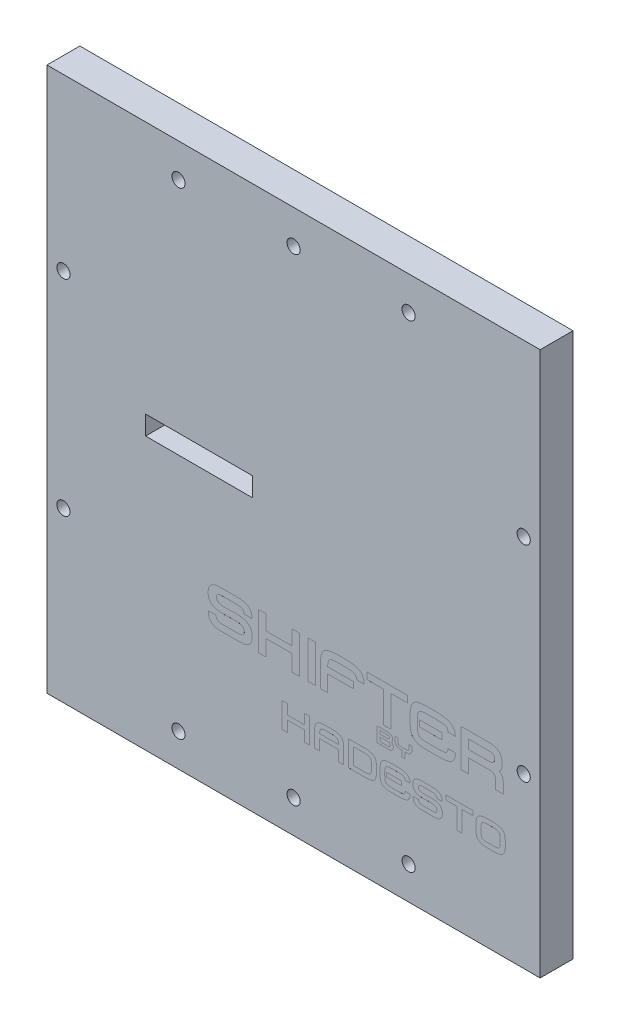
from build123d import *

# Parameters (mm, degrees)
SZKIC1_W                    = 150
SZKIC1_H                    = 10
DODANIE_WYCI_GNI_CIE1_DEPTH = 165.5
SZKIC3_W                    = 2.340552273
SZKIC3_H                    = 11.4427
WYTNIJ_WYCI_GNI_CIE4_DEPTH  = 0.001
SZKIC5_W                    = 32.48
SZKIC5_H                    = 5.8
WYTNIJ_WYCI_GNI_CIE5_DEPTH  = 10
SZKIC6_R                    = 2
WYTNIJ_WYCI_GNI_CIE6_DEPTH  = 1
SZKIC2_R                    = 2
WYTNIJ_WYCI_GNI_CIE8_DEPTH  = 10


with BuildPart() as part:
    # Szkic1 → Dodanie-wyciągnięcie1 (new body)
    with BuildSketch(Plane(origin=(0, 0, 0), x_dir=(1, 0, 0), z_dir=(0, 1, 0))):
        Rectangle(SZKIC1_W, SZKIC1_H)
    extrude(amount=DODANIE_WYCI_GNI_CIE1_DEPTH)

    # Szkic3 → Wytnij-wyciągnięcie4 (cut)
    # profile 1 of 18: a face of its own
    with BuildSketch(Plane.XY.offset(5)):
        with BuildLine():
            Line((-16.542512568, 42.832400391), (-22.123288858, 42.832400391))
            add(Edge.make_bspline(
                [(-22.123288858, 42.832400391), (-22.422042313, 42.83440431), (-22.858237206, 42.854045396), (-23.414230973, 42.947728336), (-23.788781499, 43.040027305), (-24.133562425, 43.16208995), (-24.448277119, 43.312277598), (-24.734944472, 43.48711761), (-24.987217214, 43.694905585), (-25.213935653, 43.923582429), (-25.40889511, 44.18272049), (-25.568697724, 44.470268147), (-25.704906368, 44.782595342), (-25.806269964, 45.123449133), (-25.905832807, 45.628008445), (-25.927296998, 46.024411422), (-25.928150611, 46.29519945)],
                knots=[0, 0, 0, 0, 0.151922302, 0.221134811, 0.286191508, 0.347688773, 0.406612918, 0.463100543, 0.517821253, 0.572256363, 0.626379647, 0.681995079, 0.739047103, 0.799173433, 0.862284251, 1, 1, 1, 1], degree=3))
            Line((-25.928150611, 46.29519945), (-23.554797806, 46.29519945))
            add(Edge.make_bspline(
                [(-23.554797806, 46.29519945), (-23.554751578, 46.180821676), (-23.543199145, 46.012793928), (-23.494151101, 45.800661123), (-23.448821313, 45.655663212), (-23.384262854, 45.524487166), (-23.308496532, 45.403352549), (-23.220325966, 45.291489786), (-23.112188471, 45.196830265), (-22.995870738, 45.107855531), (-22.862409534, 45.037017564), (-22.718445996, 44.971797356), (-22.558618614, 44.921453905), (-22.385425517, 44.881806383), (-22.127733043, 44.844186109), (-21.926944375, 44.830376724), (-21.788254849, 44.833232865)],
                knots=[0, 0, 0, 0, 0.130945227, 0.191386142, 0.248712215, 0.304229169, 0.357994818, 0.411967713, 0.466330735, 0.52187641, 0.57903531, 0.638605761, 0.702428631, 0.770231885, 0.841588023, 1, 1, 1, 1], degree=3))
            Line((-21.788254849, 44.833232865), (-16.971262384, 44.833232865))
            add(Edge.make_bspline(
                [(-16.971262384, 44.833232865), (-16.821141413, 44.833628326), (-16.603768932, 44.841681391), (-16.324615723, 44.865274956), (-16.13989718, 44.8953397), (-15.969591836, 44.924807053), (-15.774349275, 44.985256326), (-15.63567933, 45.034258072), (-15.553810807, 45.081579753)],
                knots=[0, 0, 0, 0, 0.310014709, 0.449362834, 0.57828042, 0.696618046, 0.805874912, 1, 1, 1, 1], degree=3))
            add(Edge.make_bspline(
                [(-15.553810807, 45.081579753), (-15.460602348, 45.133303576), (-15.331832672, 45.230409308), (-15.19807949, 45.397361959), (-15.115563301, 45.537486301), (-15.056089605, 45.695884437), (-14.988220052, 45.933334048), (-14.980933036, 46.126610238), (-14.977458596, 46.257713127)],
                knots=[0, 0, 0, 0, 0.232178092, 0.345784315, 0.463841982, 0.584405484, 0.713048125, 1, 1, 1, 1], degree=3))
            add(Edge.make_bspline(
                [(-14.977458596, 46.257713127), (-14.980271312, 46.40533732), (-15.00149924, 46.626881944), (-15.118055232, 46.890480367), (-15.230426364, 47.065929681), (-15.377935917, 47.22144953), (-15.626308287, 47.409416515), (-15.849207901, 47.507276559), (-16.005989575, 47.56036284)],
                knots=[0, 0, 0, 0, 0.249244707, 0.364726436, 0.480163662, 0.596825915, 0.721946619, 1, 1, 1, 1], degree=3))
            add(Edge.make_bspline(
                [(-16.005989575, 47.56036284), (-16.127688045, 47.602586001), (-16.323407595, 47.652868698), (-16.600262479, 47.703711254), (-16.83640478, 47.735935271), (-17.092731641, 47.761398711), (-17.473729914, 47.787855732), (-17.770225288, 47.789088397), (-17.974021516, 47.792309462)],
                knots=[0, 0, 0, 0, 0.194054864, 0.304223373, 0.424292964, 0.553297749, 0.692567507, 1, 1, 1, 1], degree=3))
            add(Edge.make_bspline(
                [(-17.974021516, 47.792309462), (-18.19583284, 47.791502098), (-18.562227009, 47.787132529), (-19.095478158, 47.767764039), (-19.574218875, 47.752477923), (-20.052959821, 47.737205105), (-20.589331817, 47.717682568), (-20.958854281, 47.713493879), (-21.183787896, 47.712651026)],
                knots=[0, 0, 0, 0, 0.207249272, 0.342308609, 0.498540821, 0.654773034, 0.789832371, 1, 1, 1, 1], degree=3))
            add(Edge.make_bspline(
                [(-21.183787896, 47.712651026), (-21.521268187, 47.715698564), (-22.011347572, 47.725391699), (-22.64087422, 47.782392924), (-23.063495877, 47.844340351), (-23.454221965, 47.917465826), (-23.914411838, 48.033270903), (-24.234064535, 48.156260402), (-24.431040598, 48.251516915)],
                knots=[0, 0, 0, 0, 0.30527379, 0.442865584, 0.571301332, 0.691382806, 0.802202654, 1, 1, 1, 1], degree=3))
            add(Edge.make_bspline(
                [(-24.431040598, 48.251516915), (-24.678585657, 48.374955388), (-25.02010852, 48.607182622), (-25.390618379, 49.003012411), (-25.610113018, 49.336822914), (-25.782951694, 49.705898653), (-25.948818692, 50.267042586), (-25.994557451, 50.716961898), (-25.99140878, 51.025504794)],
                knots=[0, 0, 0, 0, 0.246159863, 0.363761762, 0.480637741, 0.600407148, 0.72535946, 1, 1, 1, 1], degree=3))
            add(Edge.make_bspline(
                [(-25.99140878, 51.025504794), (-25.992671009, 51.30386528), (-25.962644752, 51.709810702), (-25.847204543, 52.222593888), (-25.731324459, 52.564909214), (-25.578261041, 52.874494673), (-25.328611286, 53.243448454), (-25.093054098, 53.479195229), (-24.913677003, 53.607375269)],
                knots=[0, 0, 0, 0, 0.287331641, 0.417924524, 0.541529787, 0.65938178, 0.773151266, 1, 1, 1, 1], degree=3))
            add(Edge.make_bspline(
                [(-24.913677003, 53.607375269), (-24.753614732, 53.724319382), (-24.485377703, 53.872690053), (-24.092205872, 54.022608316), (-23.760082019, 54.114353589), (-23.399191073, 54.187372908), (-22.861876031, 54.255882271), (-22.442534011, 54.278361983), (-22.153746495, 54.275100391)],
                knots=[0, 0, 0, 0, 0.205829485, 0.317155703, 0.436984505, 0.563784613, 0.699797751, 1, 1, 1, 1], degree=3))
            Line((-22.153746495, 54.275100391), (-16.844746045, 54.275100391))
            add(Edge.make_bspline(
                [(-16.844746045, 54.275100391), (-16.514040808, 54.272924598), (-16.032033705, 54.253763699), (-15.416670144, 54.159747702), (-15.002368741, 54.06776744), (-14.621519295, 53.945534416), (-14.272083177, 53.798761474), (-13.956715796, 53.622998872), (-13.674421528, 53.419373768), (-13.424590186, 53.189850015), (-13.209403882, 52.93059789), (-13.025222176, 52.646608417), (-12.877829866, 52.332975907), (-12.759765428, 51.994929061), (-12.648872615, 51.492234481), (-12.620484094, 51.096865101), (-12.620506057, 50.826358704)],
                knots=[0, 0, 0, 0, 0.159185356, 0.231380934, 0.299177103, 0.363086624, 0.423506478, 0.48118809, 0.536338715, 0.590564411, 0.643900735, 0.697976609, 0.752917048, 0.810175151, 0.869863143, 1, 1, 1, 1], degree=3))
            Line((-12.620506057, 50.826358704), (-15.071174403, 50.826358704))
            add(Edge.make_bspline(
                [(-15.071174403, 50.826358704), (-15.069084386, 50.941194158), (-15.085497121, 51.108674253), (-15.135082008, 51.32206839), (-15.189960397, 51.465470651), (-15.257396978, 51.598776984), (-15.343857263, 51.718369873), (-15.441143176, 51.830400105), (-15.558885497, 51.925475528), (-15.687276765, 52.01433989), (-15.834713334, 52.084984287), (-15.994579215, 52.149620804), (-16.170624962, 52.200007747), (-16.361646037, 52.240183375), (-16.646034333, 52.276891745), (-16.867710257, 52.291635872), (-17.020463182, 52.288325289)],
                knots=[0, 0, 0, 0, 0.12373596, 0.180989677, 0.235950535, 0.289116884, 0.341745777, 0.394885382, 0.448749002, 0.504633205, 0.563072603, 0.624754491, 0.690648222, 0.760423942, 0.835299916, 1, 1, 1, 1], degree=3))
            Line((-17.020463182, 52.288325289), (-22.027230156, 52.288325289))
            add(Edge.make_bspline(
                [(-22.027230156, 52.288325289), (-22.237115902, 52.286860891), (-22.540500366, 52.259159743), (-22.897172127, 52.117204324), (-23.106326436, 51.974149472), (-23.267138631, 51.785357048), (-23.427708095, 51.464386689), (-23.455416988, 51.182927545), (-23.458739104, 50.992704261)],
                knots=[0, 0, 0, 0, 0.28617742, 0.406448566, 0.51760179, 0.626596097, 0.739419835, 1, 1, 1, 1], degree=3))
            add(Edge.make_bspline(
                [(-23.458739104, 50.992704261), (-23.45695375, 50.885682649), (-23.439665203, 50.725253112), (-23.361059869, 50.52938136), (-23.283755313, 50.393993025), (-23.181156667, 50.270810543), (-23.054833178, 50.160932127), (-22.9080302, 50.05933582), (-22.738989471, 49.96858367), (-22.548166298, 49.88918654), (-22.334753976, 49.821303193), (-22.099638703, 49.76436891), (-21.841887333, 49.714057612), (-21.56171571, 49.677687015), (-21.14388052, 49.643420843), (-20.819267432, 49.632185419), (-20.595721208, 49.633825064)],
                knots=[0, 0, 0, 0, 0.091832613, 0.135566021, 0.179507576, 0.224524878, 0.271785124, 0.322123736, 0.37675359, 0.435361319, 0.498445969, 0.567862779, 0.641920655, 0.722688477, 0.809064572, 1, 1, 1, 1], degree=3))
            add(Edge.make_bspline(
                [(-20.595721208, 49.633825064), (-20.384712024, 49.631285659), (-20.041132218, 49.644982602), (-19.546760779, 49.663890455), (-19.113461183, 49.688023749), (-18.681605734, 49.710040531), (-18.196079055, 49.735661584), (-17.860013454, 49.74084446), (-17.655387773, 49.743941137)],
                knots=[0, 0, 0, 0, 0.215036783, 0.350500079, 0.504366675, 0.657438174, 0.791346006, 1, 1, 1, 1], degree=3))
            add(Edge.make_bspline(
                [(-17.655387773, 49.743941137), (-17.301296909, 49.744241875), (-16.787103202, 49.727570637), (-16.126156643, 49.665713964), (-15.682495499, 49.596133448), (-15.272134722, 49.515328707), (-14.790163515, 49.377024979), (-14.451388989, 49.248296027), (-14.246475303, 49.137131288)],
                knots=[0, 0, 0, 0, 0.304044834, 0.441512067, 0.569747136, 0.689567347, 0.800388045, 1, 1, 1, 1], degree=3))
            add(Edge.make_bspline(
                [(-14.246475303, 49.137131288), (-13.980059598, 49.001536034), (-13.616274354, 48.748407121), (-13.217615902, 48.328182965), (-12.980940618, 47.981234354), (-12.79664715, 47.599777454), (-12.617048256, 47.028830496), (-12.569768568, 46.570196797), (-12.571305258, 46.257713127)],
                knots=[0, 0, 0, 0, 0.254403592, 0.373969577, 0.491718452, 0.610755608, 0.733648628, 1, 1, 1, 1], degree=3))
            add(Edge.make_bspline(
                [(-12.571305258, 46.257713127), (-12.572216669, 45.966442467), (-12.597140005, 45.540817733), (-12.712795989, 45.002927774), (-12.829953285, 44.643718233), (-12.979623966, 44.31586119), (-13.223840642, 43.922559529), (-13.462019798, 43.672190527), (-13.639665455, 43.530583151)],
                knots=[0, 0, 0, 0, 0.288468082, 0.419707501, 0.543339316, 0.661573202, 0.775413558, 1, 1, 1, 1], degree=3))
            add(Edge.make_bspline(
                [(-13.639665455, 43.530583151), (-13.795597672, 43.404960412), (-14.068400603, 43.254275437), (-14.467840402, 43.09506499), (-14.816060597, 43.002058858), (-15.196834225, 42.924099613), (-15.775724033, 42.85171901), (-16.228909172, 42.833093055), (-16.542512568, 42.832400391)],
                knots=[0, 0, 0, 0, 0.196904714, 0.30637113, 0.424122327, 0.552441328, 0.690159053, 1, 1, 1, 1], degree=3))
        make_face()
    # profile 2 of 18: a face of its own
    with BuildSketch(Plane.XY.offset(5)):
        Polygon((1.874986347, 42.832400391), (-0.465565926, 42.832400391), (-0.465565926, 47.743108663), (-8.328322109, 47.743108663), (-8.328322109, 42.832400391), (-10.668874382, 42.832400391), (-10.668874382, 54.275100391), (-8.328322109, 54.275100391), (-8.328322109, 49.727540871), (-0.465565926, 49.727540871), (-0.465565926, 54.275100391), (1.874986347, 54.275100391), align=None)
    # profile 3 of 18: a face of its own
    with BuildSketch(Plane.XY.offset(5)):
        with Locations((5.535760047, 48.553750391)):
            Rectangle(SZKIC3_W, SZKIC3_H)
    # profile 4 of 18: a face of its own
    with BuildSketch(Plane.XY.offset(5)):
        with BuildLine():
            Line((10.353923959, 49.680682967), (18.204965667, 49.680682967))
            Line((18.204965667, 49.680682967), (18.204965667, 47.775909196))
            Line((18.204965667, 47.775909196), (10.353923959, 47.775909196))
            Line((10.353923959, 47.775909196), (10.353923959, 42.832400391))
            Line((10.353923959, 42.832400391), (8.12348776, 42.832400391))
            Line((8.12348776, 42.832400391), (8.139888026, 48.766953852))
            add(Edge.make_bspline(
                [(8.139888026, 48.766953852), (8.136223824, 49.129546201), (8.151663373, 49.65378104), (8.18690294, 50.325673132), (8.230349031, 50.769284594), (8.280490386, 51.172791681), (8.358692705, 51.634403035), (8.445107441, 51.956217604), (8.512408357, 52.154780264)],
                knots=[0, 0, 0, 0, 0.317800877, 0.459770024, 0.58976232, 0.708488739, 0.816214059, 1, 1, 1, 1], degree=3))
            add(Edge.make_bspline(
                [(8.512408357, 52.154780264), (8.582274378, 52.353614737), (8.71519439, 52.637438112), (8.942050988, 52.98197737), (9.138715725, 53.211040751), (9.360227911, 53.415379149), (9.692141158, 53.661457269), (9.973024409, 53.80268049), (10.168835241, 53.881494003)],
                knots=[0, 0, 0, 0, 0.255571256, 0.378596101, 0.499596222, 0.62099289, 0.743641103, 1, 1, 1, 1], degree=3))
            add(Edge.make_bspline(
                [(10.168835241, 53.881494003), (10.377082685, 53.968033784), (10.71953271, 54.063973302), (11.206894843, 54.167138049), (11.6306627, 54.226966509), (12.093719739, 54.280280402), (12.790592332, 54.325932897), (13.333899816, 54.338822675), (13.70894984, 54.338358561)],
                knots=[0, 0, 0, 0, 0.188096828, 0.296817254, 0.416307633, 0.54573704, 0.686461057, 1, 1, 1, 1], degree=3))
            Line((13.70894984, 54.338358561), (15.775383378, 54.338358561))
            add(Edge.make_bspline(
                [(15.775383378, 54.338358561), (16.255209059, 54.338412348), (16.945479394, 54.31948511), (17.824275929, 54.240879395), (18.39191393, 54.156796874), (18.900204065, 54.054062463), (19.463954239, 53.888406519), (19.84825419, 53.724997963), (20.067567326, 53.581603422)],
                knots=[0, 0, 0, 0, 0.326658008, 0.469759159, 0.600360482, 0.717142396, 0.822452319, 1, 1, 1, 1], degree=3))
            add(Edge.make_bspline(
                [(20.067567326, 53.581603422), (20.270837029, 53.449322563), (20.551412534, 53.204296377), (20.848042374, 52.79975726), (21.047041147, 52.453349125), (21.207848937, 52.061357752), (21.398188792, 51.465447445), (21.472882524, 50.984445776), (21.510790749, 50.652984462)],
                knots=[0, 0, 0, 0, 0.215512447, 0.327131176, 0.444654477, 0.569707877, 0.702963159, 1, 1, 1, 1], degree=3))
            Line((21.510790749, 50.652984462), (19.29441192, 50.652984462))
            add(Edge.make_bspline(
                [(19.29441192, 50.652984462), (19.253817319, 50.830632383), (19.174942613, 51.083649952), (19.027524262, 51.391592759), (18.899628808, 51.585413537), (18.755971052, 51.753524747), (18.542709387, 51.944006075), (18.351939602, 52.042821721), (18.219023038, 52.0891792)],
                knots=[0, 0, 0, 0, 0.291343801, 0.422029009, 0.544636847, 0.661527919, 0.774773501, 1, 1, 1, 1], degree=3))
            add(Edge.make_bspline(
                [(18.219023038, 52.0891792), (18.09319646, 52.1353921), (17.877232283, 52.177426153), (17.562237386, 52.224204051), (17.266654904, 52.253499004), (16.931477541, 52.276693371), (16.40348422, 52.297990426), (15.98713667, 52.307902106), (15.695724942, 52.304725555)],
                knots=[0, 0, 0, 0, 0.157646713, 0.259244268, 0.376058952, 0.508256356, 0.655950337, 1, 1, 1, 1], degree=3))
            Line((15.695724942, 52.304725555), (13.821408808, 52.304725555))
            add(Edge.make_bspline(
                [(13.821408808, 52.304725555), (13.497975016, 52.303921956), (13.036562209, 52.294028746), (12.453870568, 52.252939014), (12.087623734, 52.209917474), (11.769433331, 52.151292861), (11.433151857, 52.070181379), (11.210571745, 51.981220496), (11.089593042, 51.899404691)],
                knots=[0, 0, 0, 0, 0.347896457, 0.49613181, 0.628133571, 0.744281889, 0.843901062, 1, 1, 1, 1], degree=3))
            add(Edge.make_bspline(
                [(11.089593042, 51.899404691), (10.967170148, 51.823022711), (10.814408676, 51.653779218), (10.657200962, 51.377480222), (10.559466136, 51.117423404), (10.477762448, 50.817757718), (10.390625634, 50.336467186), (10.361540518, 49.951035556), (10.353923959, 49.680682967)],
                knots=[0, 0, 0, 0, 0.177190849, 0.27882497, 0.393352803, 0.521096447, 0.664120496, 1, 1, 1, 1], degree=3))
        make_face()
    # profile 5 of 18: a face of its own
    with BuildSketch(Plane.XY.offset(5)):
        Polygon((34.670832907, 52.274267918), (29.647665667, 52.274267918), (29.647665667, 42.832400391), (27.307113394, 42.832400391), (27.307113394, 52.274267918), (22.300346421, 52.274267918), (22.300346421, 54.275100391), (34.670832907, 54.275100391), align=None)
    # profile 6 of 18: a face of its own
    with BuildSketch(Plane.XY.offset(5)):
        with BuildLine():
            Line((43.43091794, 42.832400391), (40.968535118, 42.832400391))
            add(Edge.make_bspline(
                [(40.968535118, 42.832400391), (40.60058593, 42.833056305), (40.06825061, 42.844083204), (39.385642583, 42.884778609), (38.93296567, 42.928242202), (38.521359549, 42.987433129), (38.047403672, 43.07165289), (37.716125182, 43.161533809), (37.512764746, 43.237721255)],
                knots=[0, 0, 0, 0, 0.315853452, 0.456901686, 0.586909503, 0.706079852, 0.813768451, 1, 1, 1, 1], degree=3))
            add(Edge.make_bspline(
                [(37.512764746, 43.237721255), (37.315728976, 43.308009758), (37.037146251, 43.446637441), (36.699043067, 43.679065409), (36.476653103, 43.880646821), (36.274342821, 44.10202241), (36.037313876, 44.438429081), (35.893724181, 44.716693386), (35.821194434, 44.915234196)],
                knots=[0, 0, 0, 0, 0.254655329, 0.377777486, 0.499185872, 0.619886156, 0.742779715, 1, 1, 1, 1], degree=3))
            add(Edge.make_bspline(
                [(35.821194434, 44.915234196), (35.744043857, 45.118426625), (35.657336607, 45.450403965), (35.566766037, 45.923288649), (35.513672184, 46.335879589), (35.464617841, 46.78788473), (35.426218548, 47.470835579), (35.413626065, 48.002990955), (35.413530675, 48.371004568)],
                knots=[0, 0, 0, 0, 0.1862133, 0.294014373, 0.413080626, 0.543143086, 0.684177498, 1, 1, 1, 1], degree=3))
            add(Edge.make_bspline(
                [(35.413530675, 48.371004568), (35.412936909, 48.763899205), (35.421050273, 49.33054653), (35.459246675, 50.05605102), (35.49899348, 50.532586306), (35.547156871, 50.965713706), (35.622299257, 51.455469171), (35.702364402, 51.797455125), (35.767307846, 52.007177869)],
                knots=[0, 0, 0, 0, 0.321609357, 0.463728706, 0.594586506, 0.712970982, 0.820379201, 1, 1, 1, 1], degree=3))
            add(Edge.make_bspline(
                [(35.767307846, 52.007177869), (35.83422884, 52.22084636), (35.960580263, 52.527127678), (36.186872055, 52.895997494), (36.379192316, 53.139971538), (36.594632215, 53.359533756), (36.923232449, 53.615618743), (37.200046647, 53.766517136), (37.395619987, 53.846350576)],
                knots=[0, 0, 0, 0, 0.264263494, 0.388825993, 0.509593675, 0.630160731, 0.750928413, 1, 1, 1, 1], degree=3))
            add(Edge.make_bspline(
                [(37.395619987, 53.846350576), (37.604824373, 53.936854215), (37.950123758, 54.038589509), (38.443057608, 54.143397241), (38.872804041, 54.207097563), (39.344869683, 54.258393767), (40.057821571, 54.308840807), (40.614554399, 54.323459087), (40.998992755, 54.321958295)],
                knots=[0, 0, 0, 0, 0.186673139, 0.294793961, 0.413464869, 0.543078359, 0.684474125, 1, 1, 1, 1], degree=3))
            Line((40.998992755, 54.321958295), (43.463718472, 54.321958295))
            add(Edge.make_bspline(
                [(43.463718472, 54.321958295), (43.938862705, 54.320203949), (44.625895517, 54.300588702), (45.502134707, 54.208583041), (46.078559169, 54.11230024), (46.601824345, 53.99350365), (47.201504859, 53.8015602), (47.611708877, 53.611042169), (47.851961122, 53.452744187)],
                knots=[0, 0, 0, 0, 0.314844944, 0.454823659, 0.583341739, 0.701810237, 0.809960191, 1, 1, 1, 1], degree=3))
            add(Edge.make_bspline(
                [(47.851961122, 53.452744187), (48.067805964, 53.313458983), (48.367020437, 53.069970671), (48.679214178, 52.669305056), (48.870893991, 52.343640434), (49.018892871, 51.986322437), (49.162747212, 51.455934757), (49.199467621, 51.034132015), (49.199125843, 50.746700269)],
                knots=[0, 0, 0, 0, 0.243950048, 0.361591219, 0.48010578, 0.601286494, 0.727241657, 1, 1, 1, 1], degree=3))
            Line((49.199125843, 50.746700269), (46.952289377, 50.746700269))
            add(Edge.make_bspline(
                [(46.952289377, 50.746700269), (46.950173465, 50.914216269), (46.933249927, 51.160442393), (46.829300311, 51.457243325), (46.732765178, 51.648663216), (46.599602042, 51.810394898), (46.38295567, 51.998773839), (46.181896844, 52.091724592), (46.040903157, 52.136037103)],
                knots=[0, 0, 0, 0, 0.281221084, 0.405304002, 0.523085054, 0.637090674, 0.752606565, 1, 1, 1, 1], degree=3))
            add(Edge.make_bspline(
                [(46.040903157, 52.136037103), (45.909067367, 52.17464452), (45.685527921, 52.215464552), (45.357175994, 52.25107215), (45.047007313, 52.276516474), (44.693178449, 52.297809414), (44.133923822, 52.31560906), (43.692605373, 52.322927904), (43.384060036, 52.321125821)],
                knots=[0, 0, 0, 0, 0.154176449, 0.254889692, 0.37115572, 0.503932808, 0.653245043, 1, 1, 1, 1], degree=3))
            Line((43.384060036, 52.321125821), (41.111451724, 52.321125821))
            add(Edge.make_bspline(
                [(41.111451724, 52.321125821), (40.784879881, 52.320478249), (40.318051183, 52.310116527), (39.728283243, 52.269517972), (39.355885514, 52.225965791), (39.032111498, 52.167997932), (38.687804122, 52.085743817), (38.458914494, 51.997509192), (38.332778054, 51.915804957)],
                knots=[0, 0, 0, 0, 0.345644478, 0.493985201, 0.625519724, 0.742252533, 0.841884301, 1, 1, 1, 1], degree=3))
            add(Edge.make_bspline(
                [(38.332778054, 51.915804957), (38.209061774, 51.833443052), (38.048617236, 51.656765416), (37.898372694, 51.35926945), (37.80234677, 51.080480559), (37.72226188, 50.757700477), (37.646751989, 50.236346808), (37.627380703, 49.820220848), (37.625223714, 49.528394781)],
                knots=[0, 0, 0, 0, 0.172182951, 0.272744527, 0.386755583, 0.515243516, 0.659813711, 1, 1, 1, 1], degree=3))
            Line((37.625223714, 49.528394781), (37.627566609, 47.923511591))
            add(Edge.make_bspline(
                [(37.627566609, 47.923511591), (37.626891047, 47.593092448), (37.635554035, 47.121468762), (37.706987468, 46.531126992), (37.777885272, 46.166371253), (37.869652707, 45.853275373), (38.014992757, 45.525904117), (38.168446569, 45.323759612), (38.295291732, 45.231525043)],
                knots=[0, 0, 0, 0, 0.347584885, 0.494830619, 0.624602041, 0.737837282, 0.837036243, 1, 1, 1, 1], degree=3))
            add(Edge.make_bspline(
                [(38.295291732, 45.231525043), (38.415470932, 45.145915949), (38.639900887, 45.052775719), (38.978276026, 44.962041594), (39.301131769, 44.902381803), (39.671972311, 44.856554191), (40.264059468, 44.812655556), (40.733261963, 44.799592207), (41.062250925, 44.800432332)],
                knots=[0, 0, 0, 0, 0.155206199, 0.255592002, 0.370997274, 0.502801868, 0.651395086, 1, 1, 1, 1], degree=3))
            Line((41.062250925, 44.800432332), (43.400460303, 44.800432332))
            add(Edge.make_bspline(
                [(43.400460303, 44.800432332), (43.716033311, 44.798650702), (44.165941186, 44.805856038), (44.734571903, 44.823680713), (45.091514411, 44.84510184), (45.402498124, 44.870232417), (45.727023702, 44.905749613), (45.945991077, 44.946290708), (46.073703689, 44.985521051)],
                knots=[0, 0, 0, 0, 0.352451819, 0.502580475, 0.635403884, 0.751817299, 0.851038538, 1, 1, 1, 1], degree=3))
            add(Edge.make_bspline(
                [(46.073703689, 44.985521051), (46.214761062, 45.028112184), (46.417111897, 45.118989494), (46.631125467, 45.311595937), (46.760984791, 45.47918579), (46.859063507, 45.675945186), (46.953365567, 45.989611981), (46.972416973, 46.245186002), (46.968689643, 46.421715789)],
                knots=[0, 0, 0, 0, 0.24156096, 0.354454704, 0.467197092, 0.585822661, 0.711271118, 1, 1, 1, 1], degree=3))
            Line((46.968689643, 46.421715789), (49.22958348, 46.421715789))
            add(Edge.make_bspline(
                [(49.22958348, 46.421715789), (49.230097622, 46.064842368), (49.19216756, 45.54714882), (49.025503305, 44.903510748), (48.85351015, 44.490822927), (48.634412134, 44.1265481), (48.272910225, 43.705927736), (47.924778333, 43.473283379), (47.676243984, 43.354866014)],
                knots=[0, 0, 0, 0, 0.294114227, 0.424501136, 0.545829666, 0.660956259, 0.7731031, 1, 1, 1, 1], degree=3))
            add(Edge.make_bspline(
                [(47.676243984, 43.354866014), (47.464912682, 43.254764253), (47.102207562, 43.135546131), (46.564847707, 43.028437096), (46.066434091, 42.957626779), (45.50227837, 42.898748718), (44.616392, 42.846961195), (43.918497908, 42.828993781), (43.43091794, 42.832400391)],
                knots=[0, 0, 0, 0, 0.162710407, 0.264981933, 0.38160847, 0.513497487, 0.660216093, 1, 1, 1, 1], degree=3))
        make_face()
    # profile 7 of 18: a face of its own
    with BuildSketch(Plane.XY.offset(5)):
        Polygon((45.17637484, 47.775909196), (38.332778054, 47.799338147), (38.332778054, 49.697083233), (45.17637484, 49.697083233), align=None)
    # profile 8 of 18: a face of its own
    with BuildSketch(Plane.XY.offset(5)):
        with BuildLine():
            Line((63.788334054, 42.832400391), (61.464182047, 42.832400391))
            Line((61.464182047, 42.832400391), (61.464182047, 45.015978688))
            add(Edge.make_bspline(
                [(61.464182047, 45.015978688), (61.463587156, 45.191086605), (61.453521007, 45.44512577), (61.404074283, 45.766974591), (61.359356385, 45.979485189), (61.2952878, 46.170728656), (61.218370206, 46.341870152), (61.12913159, 46.495053387), (61.022672444, 46.627809995), (60.897750388, 46.742866783), (60.753039743, 46.841461342), (60.587997631, 46.92615938), (60.401328237, 46.993730701), (60.19301329, 47.044529821), (59.875381317, 47.095138398), (59.624663463, 47.109726648), (59.451635098, 47.108184073)],
                knots=[0, 0, 0, 0, 0.155011784, 0.224175814, 0.287859163, 0.346835827, 0.402172914, 0.453585721, 0.503208761, 0.55209072, 0.603247683, 0.657619286, 0.715748493, 0.778404625, 0.846993692, 1, 1, 1, 1], degree=3))
            Line((59.451635098, 47.108184073), (53.266391855, 47.091783807))
            Line((53.266391855, 47.091783807), (53.266391855, 42.832400391))
            Line((53.266391855, 42.832400391), (50.989097751, 42.832400391))
            Line((50.989097751, 42.832400391), (50.989097751, 54.275100391))
            Line((50.989097751, 54.275100391), (59.292318226, 54.275100391))
            add(Edge.make_bspline(
                [(59.292318226, 54.275100391), (59.629522519, 54.277823501), (60.116953355, 54.25347755), (60.738166914, 54.166928674), (61.148237826, 54.080849225), (61.518437339, 53.962173264), (61.949187273, 53.782762266), (62.234832155, 53.598250901), (62.398997219, 53.455087083)],
                knots=[0, 0, 0, 0, 0.308563432, 0.445716134, 0.573699083, 0.691455971, 0.800969481, 1, 1, 1, 1], degree=3))
            add(Edge.make_bspline(
                [(62.398997219, 53.455087083), (62.574347885, 53.298789654), (62.803200113, 53.023062416), (63.043417941, 52.604027362), (63.187556567, 52.250343592), (63.303546526, 51.864713247), (63.409040464, 51.284747307), (63.440763003, 50.829866827), (63.439242674, 50.517096542)],
                knots=[0, 0, 0, 0, 0.218918775, 0.33232409, 0.450084974, 0.574981528, 0.707931514, 1, 1, 1, 1], degree=3))
            add(Edge.make_bspline(
                [(63.439242674, 50.517096542), (63.436538994, 50.236350811), (63.417543249, 49.832618123), (63.305625937, 49.333929449), (63.198079873, 49.021946554), (63.051734102, 48.757532485), (62.821466376, 48.464034431), (62.588379807, 48.312571362), (62.422426171, 48.246831124)],
                knots=[0, 0, 0, 0, 0.319412201, 0.455762304, 0.579143684, 0.692631121, 0.79729967, 1, 1, 1, 1], degree=3))
            add(Edge.make_bspline(
                [(62.422426171, 48.246831124), (62.531912145, 48.220350294), (62.69348586, 48.171083277), (62.886675994, 48.063632712), (63.022402142, 47.975773879), (63.14423214, 47.868384451), (63.257031702, 47.748296095), (63.361019857, 47.615326669), (63.449442669, 47.465346899), (63.52983876, 47.30264899), (63.599414644, 47.125487051), (63.657983591, 46.93340384), (63.70715717, 46.727736741), (63.7443796, 46.506988294), (63.778461841, 46.184401177), (63.789808773, 45.934645788), (63.788334054, 45.763362246)],
                knots=[0, 0, 0, 0, 0.109952973, 0.162653118, 0.214708369, 0.266962896, 0.320180924, 0.374896837, 0.430802819, 0.489253564, 0.5513401, 0.615754487, 0.684500673, 0.756955777, 0.83340111, 1, 1, 1, 1], degree=3))
            Line((63.788334054, 45.763362246), (63.788334054, 42.832400391))
        make_face()
        with BuildLine():
            Line((59.468035364, 52.068093143), (53.266391855, 52.068093143))
            Line((53.266391855, 52.068093143), (53.266391855, 49.298791055))
            Line((53.266391855, 49.298791055), (59.468035364, 49.298791055))
            add(Edge.make_bspline(
                [(59.468035364, 49.298791055), (59.713460564, 49.302597378), (60.068182937, 49.328025959), (60.48744934, 49.486550085), (60.730164252, 49.648004027), (60.920683054, 49.856529249), (61.105179387, 50.214119895), (61.14711558, 50.5265248), (61.145548304, 50.739671583)],
                knots=[0, 0, 0, 0, 0.292647434, 0.414933396, 0.527701918, 0.635233364, 0.746265615, 1, 1, 1, 1], degree=3))
            add(Edge.make_bspline(
                [(61.145548304, 50.739671583), (61.147844386, 50.936928083), (61.10350185, 51.227504629), (60.919457494, 51.55642004), (60.728288947, 51.747959429), (60.484699774, 51.893461725), (60.066951407, 52.04352407), (59.712935234, 52.06434136), (59.468035364, 52.068093143)],
                knots=[0, 0, 0, 0, 0.243091442, 0.351382042, 0.45789428, 0.571595969, 0.697253566, 1, 1, 1, 1], degree=3))
        make_face(mode=Mode.SUBTRACT)
    # profile 9 of 18: a face of its own
    with BuildSketch(Plane.XY.offset(5)):
        Polygon((4.900127285, 26.250960101), (3.339759103, 26.250960101), (3.339759103, 29.524765615), (-1.902078352, 29.524765615), (-1.902078352, 26.250960101), (-3.462446534, 26.250960101), (-3.462446534, 33.879426767), (-1.902078352, 33.879426767), (-1.902078352, 30.84772042), (3.339759103, 30.84772042), (3.339759103, 33.879426767), (4.900127285, 33.879426767), align=None)
    # profile 10 of 18: a face of its own
    with BuildSketch(Plane.XY.offset(5)):
        with BuildLine():
            Line((13.701603466, 29.524765615), (7.941205213, 29.524765615))
            Line((7.941205213, 29.524765615), (7.941205213, 26.250960101))
            Line((7.941205213, 26.250960101), (6.380837031, 26.250960101))
            Line((6.380837031, 26.250960101), (6.380837031, 30.758690404))
            add(Edge.make_bspline(
                [(6.380837031, 30.758690404), (6.380913782, 30.909736983), (6.386323231, 31.131863315), (6.407674217, 31.421242293), (6.428705939, 31.624614468), (6.459093338, 31.817671836), (6.493048991, 32.001222133), (6.532989243, 32.175150342), (6.58226459, 32.338820302), (6.634422714, 32.493643844), (6.69415279, 32.638835895), (6.761168703, 32.773567669), (6.832878914, 32.900156012), (6.912857567, 33.015753042), (7.026416357, 33.155624631), (7.120110742, 33.251034334), (7.189916829, 33.304636486)],
                knots=[0, 0, 0, 0, 0.164418408, 0.241695767, 0.315790914, 0.386880089, 0.454344293, 0.518948986, 0.580990108, 0.640308359, 0.696715684, 0.751710512, 0.804005532, 0.854934813, 0.904496359, 1, 1, 1, 1], degree=3))
            add(Edge.make_bspline(
                [(7.189916829, 33.304636486), (7.319814898, 33.409300439), (7.551492652, 33.538765349), (7.901367696, 33.661605513), (8.213276034, 33.742532643), (8.563355375, 33.80343568), (9.104513422, 33.866142015), (9.531611953, 33.878023579), (9.828016788, 33.879426767)],
                knots=[0, 0, 0, 0, 0.181810588, 0.287672901, 0.404740533, 0.533690843, 0.675806459, 1, 1, 1, 1], degree=3))
            Line((9.828016788, 33.879426767), (11.703894853, 33.879426767))
            add(Edge.make_bspline(
                [(11.703894853, 33.879426767), (12.004927368, 33.877277127), (12.438975499, 33.867304515), (12.989438076, 33.801879833), (13.345916912, 33.738846701), (13.665082785, 33.659674595), (14.020985832, 33.530453833), (14.258762739, 33.400896211), (14.391976575, 33.293702975)],
                knots=[0, 0, 0, 0, 0.323218464, 0.464989803, 0.594402708, 0.711468114, 0.81732855, 1, 1, 1, 1], degree=3))
            add(Edge.make_bspline(
                [(14.391976575, 33.293702975), (14.541231133, 33.175741789), (14.735936206, 32.954979622), (14.931545615, 32.606540355), (15.055613223, 32.305134231), (15.149378149, 31.967840011), (15.241042165, 31.450567166), (15.263018008, 31.041499259), (15.263533578, 30.758690404)],
                knots=[0, 0, 0, 0, 0.205459765, 0.315072994, 0.431639834, 0.55767728, 0.693518199, 1, 1, 1, 1], degree=3))
            Line((15.263533578, 30.758690404), (15.263533578, 26.250960101))
            Line((15.263533578, 26.250960101), (13.701603466, 26.250960101))
            Line((13.701603466, 26.250960101), (13.701603466, 29.524765615))
        make_face()
        with BuildLine():
            Line((7.939643283, 30.84772042), (13.692231885, 30.84772042))
            add(Edge.make_bspline(
                [(13.692231885, 30.84772042), (13.692614771, 31.016487841), (13.675541623, 31.257944511), (13.625240301, 31.562144139), (13.572957624, 31.754532135), (13.505551342, 31.922450094), (13.401805178, 32.108834462), (13.293543768, 32.220540356), (13.212719341, 32.276886472)],
                knots=[0, 0, 0, 0, 0.3240439, 0.464160161, 0.591813718, 0.70624003, 0.81108294, 1, 1, 1, 1], degree=3))
            add(Edge.make_bspline(
                [(13.212719341, 32.276886472), (13.13672685, 32.329300813), (12.997490002, 32.38809786), (12.788072067, 32.445397323), (12.589394321, 32.481774088), (12.362108577, 32.511145022), (12.000129379, 32.538229419), (11.713889023, 32.545121223), (11.513339379, 32.545538452)],
                knots=[0, 0, 0, 0, 0.158283496, 0.258942466, 0.374127982, 0.506345229, 0.654083339, 1, 1, 1, 1], degree=3))
            Line((11.513339379, 32.545538452), (9.998267171, 32.545538452))
            add(Edge.make_bspline(
                [(9.998267171, 32.545538452), (9.808685645, 32.544507907), (9.537366804, 32.539275643), (9.194687347, 32.509742385), (8.978399925, 32.478395887), (8.788442097, 32.440805816), (8.585092017, 32.380559097), (8.449007196, 32.320824312), (8.375421784, 32.265952962)],
                knots=[0, 0, 0, 0, 0.341247183, 0.4879997, 0.618650443, 0.734416625, 0.836096831, 1, 1, 1, 1], degree=3))
            add(Edge.make_bspline(
                [(8.375421784, 32.265952962), (8.301336782, 32.211097077), (8.20096734, 32.102591527), (8.1095333, 31.920036565), (8.048282568, 31.75400408), (8.000875515, 31.563334817), (7.953660785, 31.259320699), (7.941920311, 31.017210232), (7.939643283, 30.84772042)],
                knots=[0, 0, 0, 0, 0.180375142, 0.283893021, 0.398091347, 0.526428741, 0.667896118, 1, 1, 1, 1], degree=3))
        make_face(mode=Mode.SUBTRACT)
    # profile 11 of 18: a face of its own
    with BuildSketch(Plane.XY.offset(5)):
        with BuildLine():
            Line((21.98920464, 26.24002659), (16.655213308, 26.24002659))
            Line((16.655213308, 26.24002659), (16.655213308, 33.879426767))
            Line((16.655213308, 33.879426767), (21.809582677, 33.879426767))
            add(Edge.make_bspline(
                [(21.809582677, 33.879426767), (22.064359027, 33.879118831), (22.433874236, 33.867147579), (22.905658225, 33.812909103), (23.219242057, 33.761747139), (23.503955785, 33.690897362), (23.835788058, 33.584235956), (24.061682878, 33.472427084), (24.196211888, 33.384294922)],
                knots=[0, 0, 0, 0, 0.309719935, 0.448550711, 0.5769045, 0.695521955, 0.804763459, 1, 1, 1, 1], degree=3))
            add(Edge.make_bspline(
                [(24.196211888, 33.384294922), (24.317280874, 33.305850883), (24.485944698, 33.169785438), (24.677966419, 32.955063624), (24.80314503, 32.777611603), (24.91082103, 32.583966038), (25.037827967, 32.300172551), (25.097434669, 32.069290045), (25.128684165, 31.911394826)],
                knots=[0, 0, 0, 0, 0.241210856, 0.36025221, 0.480825478, 0.603645366, 0.730355611, 1, 1, 1, 1], degree=3))
            add(Edge.make_bspline(
                [(25.128684165, 31.911394826), (25.153269605, 31.779967898), (25.186362075, 31.565910912), (25.210625911, 31.258081415), (25.232806204, 30.981289053), (25.24491648, 30.67335882), (25.261179634, 30.200196999), (25.263063581, 29.829335863), (25.263010154, 29.571623519)],
                knots=[0, 0, 0, 0, 0.170984739, 0.276567168, 0.39470196, 0.525968882, 0.67048687, 1, 1, 1, 1], degree=3))
            add(Edge.make_bspline(
                [(25.263010154, 29.571623519), (25.264889743, 29.283264059), (25.246155733, 28.867580355), (25.178366227, 28.339785083), (25.109547371, 27.996138174), (25.017809441, 27.689212071), (24.876027715, 27.340587975), (24.732735796, 27.109947693), (24.616371088, 26.981943393)],
                knots=[0, 0, 0, 0, 0.317701801, 0.457735795, 0.585991963, 0.703412898, 0.810158247, 1, 1, 1, 1], degree=3))
            add(Edge.make_bspline(
                [(24.616371088, 26.981943393), (24.560164114, 26.917057558), (24.461550516, 26.830996648), (24.317347815, 26.728430849), (24.198857632, 26.653998908), (24.068175203, 26.58954799), (23.928641041, 26.528214546), (23.77978439, 26.47203873), (23.619827566, 26.423851671), (23.450579718, 26.380043026), (23.270522435, 26.343444252), (23.081727236, 26.309592962), (22.882391543, 26.285734418), (22.673558789, 26.265569549), (22.37490864, 26.243103781), (22.14537393, 26.24181117), (21.98920464, 26.24002659)],
                knots=[0, 0, 0, 0, 0.091643919, 0.139592265, 0.18939982, 0.241248908, 0.295410294, 0.352558216, 0.411446484, 0.474174328, 0.539654988, 0.608107161, 0.679455027, 0.75449571, 0.832728872, 1, 1, 1, 1], degree=3))
        make_face()
        with BuildLine():
            Line((23.701080043, 29.613795632), (23.701080043, 30.546267908))
            add(Edge.make_bspline(
                [(23.701080043, 30.546267908), (23.701883202, 30.729850267), (23.689802866, 30.993058014), (23.65092071, 31.326637522), (23.606849963, 31.539505189), (23.552995195, 31.728625216), (23.487113637, 31.893559563), (23.406656297, 32.033475528), (23.312653586, 32.152145285), (23.197176517, 32.249401341), (23.060775747, 32.333594881), (22.898004096, 32.399963769), (22.712450739, 32.459056753), (22.500556446, 32.500303221), (22.170091641, 32.547196229), (21.907482605, 32.553679041), (21.725238451, 32.554910032)],
                knots=[0, 0, 0, 0, 0.163967852, 0.235227714, 0.299821125, 0.357970455, 0.410753136, 0.458068257, 0.50173217, 0.545276972, 0.592270842, 0.644374718, 0.701902952, 0.766040793, 0.836961238, 1, 1, 1, 1], degree=3))
            Line((21.725238451, 32.554910032), (18.226515, 32.554910032))
            Line((18.226515, 32.554910032), (18.226515, 27.573914905))
            Line((18.226515, 27.573914905), (21.820516188, 27.573914905))
            add(Edge.make_bspline(
                [(21.820516188, 27.573914905), (22.00650919, 27.574720174), (22.273489646, 27.582271575), (22.609217541, 27.627374227), (22.820662933, 27.672436975), (23.005368734, 27.72698568), (23.205038317, 27.816098535), (23.329923948, 27.90992274), (23.394941741, 27.983140595)],
                knots=[0, 0, 0, 0, 0.334560306, 0.479099002, 0.608330904, 0.722900218, 0.824679382, 1, 1, 1, 1], degree=3))
            add(Edge.make_bspline(
                [(23.394941741, 27.983140595), (23.452520135, 28.05481782), (23.523399286, 28.187205919), (23.584591684, 28.391706142), (23.629428223, 28.581833632), (23.659616343, 28.800498199), (23.696158213, 29.146761625), (23.699689905, 29.421718425), (23.701080043, 29.613795632)],
                knots=[0, 0, 0, 0, 0.163304622, 0.264521828, 0.379735026, 0.51106061, 0.65745786, 1, 1, 1, 1], degree=3))
        make_face(mode=Mode.SUBTRACT)
    # profile 12 of 18: a face of its own
    with BuildSketch(Plane.XY.offset(5)):
        with BuildLine():
            Line((31.604446409, 26.250960101), (29.962857861, 26.250960101))
            add(Edge.make_bspline(
                [(29.962857861, 26.250960101), (29.717558402, 26.251397376), (29.362668189, 26.258748642), (28.907596171, 26.285878912), (28.605811563, 26.314854641), (28.331407482, 26.354315259), (28.015436897, 26.410461766), (27.794584571, 26.470382379), (27.659010946, 26.52117401)],
                knots=[0, 0, 0, 0, 0.315853452, 0.456901686, 0.586909503, 0.706079852, 0.813768451, 1, 1, 1, 1], degree=3))
            add(Edge.make_bspline(
                [(27.659010946, 26.52117401), (27.527653767, 26.568033012), (27.34193195, 26.660451467), (27.116529827, 26.815403445), (26.968269851, 26.949791054), (26.83339633, 27.09737478), (26.675377033, 27.321645894), (26.57965057, 27.50715543), (26.531297405, 27.63951597)],
                knots=[0, 0, 0, 0, 0.254655329, 0.377777486, 0.499185872, 0.619886156, 0.742779715, 1, 1, 1, 1], degree=3))
            add(Edge.make_bspline(
                [(26.531297405, 27.63951597), (26.479863687, 27.774977589), (26.422058854, 27.996295817), (26.361678474, 28.311552272), (26.326282571, 28.586612899), (26.293579677, 28.88794966), (26.267980148, 29.343250225), (26.259585159, 29.698020477), (26.259521566, 29.943362885)],
                knots=[0, 0, 0, 0, 0.1862133, 0.294014373, 0.413080626, 0.543143086, 0.684177498, 1, 1, 1, 1], degree=3))
            add(Edge.make_bspline(
                [(26.259521566, 29.943362885), (26.259125722, 30.205292643), (26.264534631, 30.583057526), (26.289998899, 31.066727187), (26.316496769, 31.384417377), (26.348605696, 31.673168977), (26.398700621, 31.999672621), (26.452077384, 32.227663256), (26.495373013, 32.367478419)],
                knots=[0, 0, 0, 0, 0.321609357, 0.463728706, 0.594586506, 0.712970982, 0.820379201, 1, 1, 1, 1], degree=3))
            add(Edge.make_bspline(
                [(26.495373013, 32.367478419), (26.539987009, 32.509924079), (26.624221291, 32.714111625), (26.775082486, 32.960024836), (26.903295993, 33.122674198), (27.046922592, 33.26904901), (27.265989415, 33.439772335), (27.450532214, 33.540371264), (27.580914441, 33.593593557)],
                knots=[0, 0, 0, 0, 0.264263494, 0.388825993, 0.509593675, 0.630160731, 0.750928413, 1, 1, 1, 1], degree=3))
            add(Edge.make_bspline(
                [(27.580914441, 33.593593557), (27.720384031, 33.653929316), (27.950583621, 33.721752846), (28.279206188, 33.791624667), (28.56570381, 33.834091548), (28.880414238, 33.868289018), (29.355715496, 33.901920378), (29.726870715, 33.911665897), (29.983162953, 33.910665369)],
                knots=[0, 0, 0, 0, 0.186673139, 0.294793961, 0.413464869, 0.543078359, 0.684474125, 1, 1, 1, 1], degree=3))
            Line((29.983162953, 33.910665369), (31.62631343, 33.910665369))
            add(Edge.make_bspline(
                [(31.62631343, 33.910665369), (31.943076252, 33.909495805), (32.401098127, 33.896418974), (32.985257587, 33.835081867), (33.369540562, 33.770893333), (33.718384012, 33.691695606), (34.118171022, 33.563733306), (34.391640367, 33.436721285), (34.55180853, 33.331189298)],
                knots=[0, 0, 0, 0, 0.314844944, 0.454823659, 0.583341739, 0.701810237, 0.809960191, 1, 1, 1, 1], degree=3))
            add(Edge.make_bspline(
                [(34.55180853, 33.331189298), (34.695705092, 33.238332495), (34.895181407, 33.076006954), (35.103310567, 32.808896543), (35.23109711, 32.591786795), (35.329763029, 32.353574797), (35.425665923, 31.999983011), (35.450146196, 31.718781183), (35.449918344, 31.527160019)],
                knots=[0, 0, 0, 0, 0.243950048, 0.361591219, 0.48010578, 0.601286494, 0.727241657, 1, 1, 1, 1], degree=3))
            Line((35.449918344, 31.527160019), (33.952027367, 31.527160019))
            add(Edge.make_bspline(
                [(33.952027367, 31.527160019), (33.950616759, 31.638837353), (33.939334401, 31.802988102), (33.870034657, 32.000855389), (33.805677901, 32.12846865), (33.716902477, 32.236289772), (33.572471562, 32.361875732), (33.438432345, 32.423842901), (33.344436554, 32.453384575)],
                knots=[0, 0, 0, 0, 0.281221084, 0.405304002, 0.523085054, 0.637090674, 0.752606565, 1, 1, 1, 1], degree=3))
            add(Edge.make_bspline(
                [(33.344436554, 32.453384575), (33.256546027, 32.479122853), (33.10751973, 32.506336207), (32.888618445, 32.530074606), (32.681839324, 32.547037489), (32.445953415, 32.561232782), (32.073116997, 32.573099213), (31.778904698, 32.577978442), (31.573207807, 32.576777054)],
                knots=[0, 0, 0, 0, 0.154176449, 0.254889692, 0.37115572, 0.503932808, 0.653245043, 1, 1, 1, 1], degree=3))
            Line((31.573207807, 32.576777054), (30.058135598, 32.576777054))
            add(Edge.make_bspline(
                [(30.058135598, 32.576777054), (29.840421036, 32.576345339), (29.529201905, 32.569437524), (29.136023278, 32.542371821), (28.887758125, 32.513337033), (28.671908781, 32.474691794), (28.442370531, 32.419855718), (28.289777445, 32.361032634), (28.205686485, 32.306563144)],
                knots=[0, 0, 0, 0, 0.345644478, 0.493985201, 0.625519724, 0.742252533, 0.841884301, 1, 1, 1, 1], degree=3))
            add(Edge.make_bspline(
                [(28.205686485, 32.306563144), (28.123208965, 32.251655207), (28.016245939, 32.133870117), (27.916082912, 31.935539473), (27.852065629, 31.749680212), (27.798675702, 31.534493491), (27.748335775, 31.186924378), (27.735421584, 30.909507072), (27.733983592, 30.71495636)],
                knots=[0, 0, 0, 0, 0.172182951, 0.272744527, 0.386755583, 0.515243516, 0.659813711, 1, 1, 1, 1], degree=3))
            Line((27.733983592, 30.71495636), (27.735545522, 29.645034234))
            add(Edge.make_bspline(
                [(27.735545522, 29.645034234), (27.735095147, 29.424754805), (27.740870473, 29.110339014), (27.788492761, 28.716777835), (27.835757964, 28.473607341), (27.896936254, 28.264876755), (27.99382962, 28.046629251), (28.096132162, 27.911866248), (28.180695604, 27.850376535)],
                knots=[0, 0, 0, 0, 0.347584885, 0.494830619, 0.624602041, 0.737837282, 0.837036243, 1, 1, 1, 1], degree=3))
            add(Edge.make_bspline(
                [(28.180695604, 27.850376535), (28.260815071, 27.793303806), (28.41043504, 27.731210319), (28.636018467, 27.670720903), (28.851255629, 27.630947708), (29.098482657, 27.600395967), (29.493207428, 27.571130211), (29.806009091, 27.562421311), (30.025335066, 27.562981395)],
                knots=[0, 0, 0, 0, 0.155206199, 0.255592002, 0.370997274, 0.502801868, 0.651395086, 1, 1, 1, 1], degree=3))
            Line((30.025335066, 27.562981395), (31.584141317, 27.562981395))
            add(Edge.make_bspline(
                [(31.584141317, 27.562981395), (31.794523323, 27.561793641), (32.094461907, 27.566597198), (32.473549051, 27.578480315), (32.711510723, 27.592761066), (32.918833199, 27.609514785), (33.135183584, 27.633192915), (33.281161834, 27.660220311), (33.366303575, 27.686373873)],
                knots=[0, 0, 0, 0, 0.352451819, 0.502580475, 0.635403884, 0.751817299, 0.851038538, 1, 1, 1, 1], degree=3))
            add(Edge.make_bspline(
                [(33.366303575, 27.686373873), (33.460341824, 27.714767962), (33.59524238, 27.775352836), (33.737918094, 27.903757131), (33.824490976, 28.0154837), (33.889876787, 28.14665663), (33.952744827, 28.355767827), (33.965445764, 28.526150507), (33.962960878, 28.643837032)],
                knots=[0, 0, 0, 0, 0.24156096, 0.354454704, 0.467197092, 0.585822661, 0.711271118, 1, 1, 1, 1], degree=3))
            Line((33.962960878, 28.643837032), (35.470223436, 28.643837032))
            add(Edge.make_bspline(
                [(35.470223436, 28.643837032), (35.470566197, 28.405921418), (35.445279489, 28.060792386), (35.334169986, 27.631700338), (35.219507882, 27.356575124), (35.073442539, 27.11372524), (34.832441266, 26.833311663), (34.600353338, 26.678215426), (34.434663772, 26.599270516)],
                knots=[0, 0, 0, 0, 0.294114227, 0.424501136, 0.545829666, 0.660956259, 0.7731031, 1, 1, 1, 1], degree=3))
            add(Edge.make_bspline(
                [(34.434663772, 26.599270516), (34.293776237, 26.532536008), (34.051972824, 26.45305726), (33.69373292, 26.381651237), (33.361457176, 26.334444359), (32.985353362, 26.295192318), (32.394762449, 26.260667303), (31.929499721, 26.248689027), (31.604446409, 26.250960101)],
                knots=[0, 0, 0, 0, 0.162710407, 0.264981933, 0.38160847, 0.513497487, 0.660216093, 1, 1, 1, 1], degree=3))
        make_face()
    # profile 13 of 18: a face of its own
    with BuildSketch(Plane.XY.offset(5)):
        Polygon((32.768084342, 29.546632637), (28.205686485, 29.562251938), (28.205686485, 30.833663049), (32.768084342, 30.827415329), align=None)
    # profile 14 of 18: a face of its own
    with BuildSketch(Plane.XY.offset(5)):
        with BuildLine():
            Line((42.603558257, 26.250960101), (38.88304073, 26.250960101))
            add(Edge.make_bspline(
                [(38.88304073, 26.250960101), (38.68387176, 26.252296046), (38.393075165, 26.265390103), (38.022412654, 26.327845397), (37.772712303, 26.389378043), (37.542858353, 26.47075314), (37.333048556, 26.570878238), (37.141936988, 26.687438247), (36.97375516, 26.825963563), (36.822609534, 26.978414792), (36.692636562, 27.151173499), (36.586101487, 27.342871938), (36.495295724, 27.551090067), (36.427719993, 27.778325928), (36.361344764, 28.114698803), (36.347035304, 28.378967455), (36.346466229, 28.559492806)],
                knots=[0, 0, 0, 0, 0.151922302, 0.221134811, 0.286191508, 0.347688773, 0.406612918, 0.463100543, 0.517821253, 0.572256363, 0.626379647, 0.681995079, 0.739047103, 0.799173433, 0.862284251, 1, 1, 1, 1], degree=3))
            Line((36.346466229, 28.559492806), (37.928701432, 28.559492806))
            add(Edge.make_bspline(
                [(37.928701432, 28.559492806), (37.928732251, 28.483240957), (37.936433872, 28.371222458), (37.969132569, 28.229800589), (37.999352427, 28.133135315), (38.0423914, 28.045684617), (38.092902281, 27.964928206), (38.151682658, 27.89035303), (38.223774322, 27.827246683), (38.301319477, 27.767930193), (38.390293613, 27.720704882), (38.486269305, 27.677224744), (38.592820893, 27.643662443), (38.708282958, 27.617230761), (38.880077941, 27.592150579), (39.013937053, 27.582944322), (39.106396736, 27.584848416)],
                knots=[0, 0, 0, 0, 0.130945227, 0.191386142, 0.248712215, 0.304229169, 0.357994818, 0.411967713, 0.466330735, 0.52187641, 0.57903531, 0.638605761, 0.702428631, 0.770231885, 0.841588023, 1, 1, 1, 1], degree=3))
            Line((39.106396736, 27.584848416), (42.317725047, 27.584848416))
            add(Edge.make_bspline(
                [(42.317725047, 27.584848416), (42.417805694, 27.585112057), (42.562720681, 27.590480767), (42.74882282, 27.60620981), (42.871968516, 27.626252973), (42.985505412, 27.645897875), (43.115667119, 27.68619739), (43.208113749, 27.718865221), (43.262692764, 27.750413008)],
                knots=[0, 0, 0, 0, 0.310014709, 0.449362834, 0.57828042, 0.696618046, 0.805874912, 1, 1, 1, 1], degree=3))
            add(Edge.make_bspline(
                [(43.262692764, 27.750413008), (43.324831737, 27.784895557), (43.410678188, 27.849632712), (43.499846976, 27.960934479), (43.554857769, 28.054350707), (43.594506899, 28.159949464), (43.639753268, 28.318249205), (43.644611278, 28.447099998), (43.646927572, 28.534501924)],
                knots=[0, 0, 0, 0, 0.232178092, 0.345784315, 0.463841982, 0.584405484, 0.713048125, 1, 1, 1, 1], degree=3))
            add(Edge.make_bspline(
                [(43.646927572, 28.534501924), (43.645052428, 28.632918053), (43.630900476, 28.780614469), (43.553196481, 28.956346751), (43.478282393, 29.07331296), (43.379942691, 29.17699286), (43.214361111, 29.302304183), (43.065761368, 29.367544213), (42.961240253, 29.402935066)],
                knots=[0, 0, 0, 0, 0.249244707, 0.364726436, 0.480163662, 0.596825915, 0.721946619, 1, 1, 1, 1], degree=3))
            add(Edge.make_bspline(
                [(42.961240253, 29.402935066), (42.880107939, 29.43108384), (42.749628239, 29.464605638), (42.565058316, 29.498500675), (42.407630116, 29.519983353), (42.236745541, 29.53695898), (41.982746693, 29.554596994), (41.78508311, 29.555418771), (41.649218959, 29.557566148)],
                knots=[0, 0, 0, 0, 0.194054864, 0.304223373, 0.424292964, 0.553297749, 0.692567507, 1, 1, 1, 1], degree=3))
            add(Edge.make_bspline(
                [(41.649218959, 29.557566148), (41.501344742, 29.557027905), (41.257081963, 29.554114859), (40.901581197, 29.541202532), (40.582420719, 29.531011788), (40.263260089, 29.52082991), (39.905678758, 29.507814885), (39.659330449, 29.505022426), (39.509374705, 29.504460524)],
                knots=[0, 0, 0, 0, 0.207249272, 0.342308609, 0.498540821, 0.654773034, 0.789832371, 1, 1, 1, 1], degree=3))
            add(Edge.make_bspline(
                [(39.509374705, 29.504460524), (39.284387844, 29.506492215), (38.957668254, 29.512954306), (38.537983823, 29.550955123), (38.256236051, 29.592253407), (37.995751993, 29.641003724), (37.688958744, 29.718207108), (37.475856946, 29.800200108), (37.34453957, 29.863704449)],
                knots=[0, 0, 0, 0, 0.30527379, 0.442865584, 0.571301332, 0.691382806, 0.802202654, 1, 1, 1, 1], degree=3))
            add(Edge.make_bspline(
                [(37.34453957, 29.863704449), (37.179509531, 29.945996765), (36.951827623, 30.100814921), (36.70482105, 30.364701447), (36.55849129, 30.587241782), (36.443265507, 30.833292275), (36.332687508, 31.20738823), (36.302195002, 31.507334439), (36.304294116, 31.713029702)],
                knots=[0, 0, 0, 0, 0.246159863, 0.363761762, 0.480637741, 0.600407148, 0.72535946, 1, 1, 1, 1], degree=3))
            add(Edge.make_bspline(
                [(36.304294116, 31.713029702), (36.30345263, 31.89860336), (36.323470135, 32.169233641), (36.400430274, 32.511089098), (36.477683663, 32.739299315), (36.579725942, 32.945689622), (36.746159112, 33.191658809), (36.903197237, 33.348823326), (37.022781967, 33.434276685)],
                knots=[0, 0, 0, 0, 0.287331641, 0.417924524, 0.541529787, 0.65938178, 0.773151266, 1, 1, 1, 1], degree=3))
            add(Edge.make_bspline(
                [(37.022781967, 33.434276685), (37.129490148, 33.512239427), (37.308314834, 33.611153208), (37.570429388, 33.711098717), (37.79184529, 33.772262232), (38.032439254, 33.820941778), (38.390649282, 33.866614687), (38.670210629, 33.881601162), (38.862735639, 33.879426767)],
                knots=[0, 0, 0, 0, 0.205829485, 0.317155703, 0.436984505, 0.563784613, 0.699797751, 1, 1, 1, 1], degree=3))
            Line((38.862735639, 33.879426767), (42.402069273, 33.879426767))
            add(Edge.make_bspline(
                [(42.402069273, 33.879426767), (42.62253943, 33.877976238), (42.943877499, 33.865202306), (43.354119873, 33.802524974), (43.630320808, 33.7412048), (43.884220439, 33.659716117), (44.117177851, 33.561867489), (44.327422772, 33.444692421), (44.515618951, 33.308942351), (44.682173179, 33.155926517), (44.825630714, 32.983091766), (44.948418519, 32.793765451), (45.046680059, 32.584677111), (45.125389684, 32.359312547), (45.199318226, 32.024182827), (45.218243906, 31.76060324), (45.218229264, 31.580265642)],
                knots=[0, 0, 0, 0, 0.159185356, 0.231380934, 0.299177103, 0.363086624, 0.423506478, 0.48118809, 0.536338715, 0.590564411, 0.643900735, 0.697976609, 0.752917048, 0.810175151, 0.869863143, 1, 1, 1, 1], degree=3))
            Line((45.218229264, 31.580265642), (43.584450367, 31.580265642))
            add(Edge.make_bspline(
                [(43.584450367, 31.580265642), (43.585843712, 31.656822612), (43.574901888, 31.768476009), (43.541845297, 31.910738766), (43.505259705, 32.006340273), (43.460301984, 32.095211162), (43.402661794, 32.174939755), (43.337804519, 32.249626577), (43.259309638, 32.313010192), (43.173715459, 32.3722531), (43.075424413, 32.419349364), (42.968847159, 32.462440375), (42.851483328, 32.496031671), (42.724135944, 32.522815423), (42.534543747, 32.547287669), (42.386759798, 32.557117087), (42.284924514, 32.554910032)],
                knots=[0, 0, 0, 0, 0.12373596, 0.180989677, 0.235950535, 0.289116884, 0.341745777, 0.394885382, 0.448749002, 0.504633205, 0.563072603, 0.624754491, 0.690648222, 0.760423942, 0.835299916, 1, 1, 1, 1], degree=3))
            Line((42.284924514, 32.554910032), (38.947079865, 32.554910032))
            add(Edge.make_bspline(
                [(38.947079865, 32.554910032), (38.807156035, 32.553933767), (38.604899725, 32.535466335), (38.367118551, 32.440829389), (38.227682345, 32.345459487), (38.120474215, 32.219597872), (38.013427906, 32.005617633), (37.994955311, 31.817978203), (37.992740567, 31.69116268)],
                knots=[0, 0, 0, 0, 0.28617742, 0.406448566, 0.51760179, 0.626596097, 0.739419835, 1, 1, 1, 1], degree=3))
            add(Edge.make_bspline(
                [(37.992740567, 31.69116268), (37.993930803, 31.619814939), (38.005456501, 31.512861914), (38.057860056, 31.382280747), (38.109396427, 31.292021856), (38.177795525, 31.209900201), (38.262011184, 31.136647924), (38.359879836, 31.068917053), (38.472573655, 31.008415619), (38.599789104, 30.9554842), (38.742063985, 30.910228635), (38.8988075, 30.872272446), (39.070641747, 30.838731581), (39.257422829, 30.814484516), (39.535979622, 30.791640402), (39.752388348, 30.784150119), (39.901419163, 30.785243215)],
                knots=[0, 0, 0, 0, 0.091832613, 0.135566021, 0.179507576, 0.224524878, 0.271785124, 0.322123736, 0.37675359, 0.435361319, 0.498445969, 0.567862779, 0.641920655, 0.722688477, 0.809064572, 1, 1, 1, 1], degree=3))
            add(Edge.make_bspline(
                [(39.901419163, 30.785243215), (40.042091953, 30.783550279), (40.271145157, 30.792681575), (40.600726116, 30.80528681), (40.889592514, 30.821375672), (41.177496146, 30.836053527), (41.501180599, 30.853134229), (41.725224333, 30.85658948), (41.861641454, 30.858653931)],
                knots=[0, 0, 0, 0, 0.215036783, 0.350500079, 0.504366675, 0.657438174, 0.791346006, 1, 1, 1, 1], degree=3))
            add(Edge.make_bspline(
                [(41.861641454, 30.858653931), (42.09770203, 30.858854423), (42.440497834, 30.847740264), (42.881128874, 30.806502482), (43.17690297, 30.760115471), (43.450476821, 30.706245645), (43.771790959, 30.614043159), (43.997640643, 30.528223858), (44.134249767, 30.454114032)],
                knots=[0, 0, 0, 0, 0.304044834, 0.441512067, 0.569747136, 0.689567347, 0.800388045, 1, 1, 1, 1], degree=3))
            add(Edge.make_bspline(
                [(44.134249767, 30.454114032), (44.311860237, 30.363717196), (44.554383733, 30.194964587), (44.820156035, 29.914815149), (44.977939557, 29.683516076), (45.100801869, 29.429211476), (45.220534465, 29.04858017), (45.252054257, 28.742824371), (45.251029797, 28.534501924)],
                knots=[0, 0, 0, 0, 0.254403592, 0.373969577, 0.491718452, 0.610755608, 0.733648628, 1, 1, 1, 1], degree=3))
            add(Edge.make_bspline(
                [(45.251029797, 28.534501924), (45.25042219, 28.340321484), (45.233806633, 28.056571662), (45.156702643, 27.697978355), (45.078597779, 27.458505328), (44.978817325, 27.239933966), (44.816006208, 26.977732859), (44.657220104, 26.810820191), (44.538789666, 26.716415274)],
                knots=[0, 0, 0, 0, 0.288468082, 0.419707501, 0.543339316, 0.661573202, 0.775413558, 1, 1, 1, 1], degree=3))
            add(Edge.make_bspline(
                [(44.538789666, 26.716415274), (44.434834855, 26.632666781), (44.252966234, 26.532210131), (43.986673034, 26.426069833), (43.754526238, 26.364065745), (43.500677153, 26.312092915), (43.114750614, 26.26383918), (42.812627188, 26.251421877), (42.603558257, 26.250960101)],
                knots=[0, 0, 0, 0, 0.196904714, 0.30637113, 0.424122327, 0.552441328, 0.690159053, 1, 1, 1, 1], degree=3))
        make_face()
    # profile 15 of 18: a face of its own
    with BuildSketch(Plane.XY.offset(5)):
        Polygon((54.553885543, 32.545538452), (51.205107384, 32.545538452), (51.205107384, 26.250960101), (49.644739202, 26.250960101), (49.644739202, 32.545538452), (46.306894552, 32.545538452), (46.306894552, 33.879426767), (54.553885543, 33.879426767), align=None)
    # profile 16 of 18: a face of its own
    with BuildSketch(Plane.XY.offset(5)):
        with BuildLine():
            Line((60.50015348, 26.250960101), (59.133464632, 26.250960101))
            add(Edge.make_bspline(
                [(59.133464632, 26.250960101), (58.888169845, 26.25146448), (58.533786304, 26.258617829), (58.079251008, 26.28596564), (57.777973266, 26.314812172), (57.503090856, 26.354508235), (57.186504195, 26.410134509), (56.965206283, 26.47046477), (56.829617717, 26.52117401)],
                knots=[0, 0, 0, 0, 0.315856503, 0.456237005, 0.586246078, 0.705417578, 0.813766652, 1, 1, 1, 1], degree=3))
            add(Edge.make_bspline(
                [(56.829617717, 26.52117401), (56.696745551, 26.568713665), (56.507387755, 26.658704804), (56.280867061, 26.815997718), (56.131129641, 26.949253838), (55.996266738, 27.097066163), (55.839958549, 27.321396288), (55.748700866, 27.508139557), (55.700342246, 27.63951597)],
                knots=[0, 0, 0, 0, 0.257494786, 0.380338267, 0.502181669, 0.622608759, 0.744674287, 1, 1, 1, 1], degree=3))
            add(Edge.make_bspline(
                [(55.700342246, 27.63951597), (55.649659439, 27.776180241), (55.58933641, 27.999039637), (55.533675545, 28.317680058), (55.49411165, 28.593615831), (55.464961469, 28.896425963), (55.438015646, 29.352552184), (55.430476944, 29.708472188), (55.430128336, 29.954296396)],
                knots=[0, 0, 0, 0, 0.186659228, 0.295166553, 0.414450701, 0.543861878, 0.684928834, 1, 1, 1, 1], degree=3))
            add(Edge.make_bspline(
                [(55.430128336, 29.954296396), (55.428991707, 30.213133666), (55.436463566, 30.587143911), (55.459012632, 31.065659621), (55.483714345, 31.380842985), (55.516289682, 31.666311844), (55.564989537, 31.98992931), (55.613281503, 32.216483638), (55.656608203, 32.354982978)],
                knots=[0, 0, 0, 0, 0.321028317, 0.463924362, 0.594138547, 0.713093509, 0.820226379, 1, 1, 1, 1], degree=3))
            add(Edge.make_bspline(
                [(55.656608203, 32.354982978), (55.703140078, 32.496138475), (55.782255771, 32.703195329), (55.937585665, 32.947701626), (56.064863046, 33.113353266), (56.212391846, 33.259521567), (56.432199812, 33.435113781), (56.619334239, 33.538676884), (56.751521211, 33.593593557)],
                knots=[0, 0, 0, 0, 0.261553691, 0.385506466, 0.507216982, 0.627371223, 0.748930783, 1, 1, 1, 1], degree=3))
            add(Edge.make_bspline(
                [(56.751521211, 33.593593557), (56.891718051, 33.652643976), (57.121017186, 33.727700672), (57.45108339, 33.79689072), (57.737505732, 33.8447714), (58.052204828, 33.876709264), (58.526626868, 33.914876162), (58.8975755, 33.921477644), (59.153769723, 33.92159888)],
                knots=[0, 0, 0, 0, 0.187058809, 0.295839618, 0.414600686, 0.544093696, 0.684767419, 1, 1, 1, 1], degree=3))
            Line((59.153769723, 33.92159888), (60.51108699, 33.92159888))
            add(Edge.make_bspline(
                [(60.51108699, 33.92159888), (60.792449622, 33.922478344), (61.199544537, 33.909699068), (61.721446864, 33.871173233), (62.066818981, 33.826867441), (62.382011164, 33.773371712), (62.667036102, 33.706676833), (62.922295577, 33.628090699), (63.149040669, 33.535585382), (63.350858442, 33.427502129), (63.533825762, 33.304905839), (63.694712736, 33.160446025), (63.84093791, 33.002833425), (63.963769341, 32.823792925), (64.109781261, 32.56026405), (64.181391883, 32.34085662), (64.220671006, 32.190980316)],
                knots=[0, 0, 0, 0, 0.189092211, 0.273697383, 0.351659682, 0.423062724, 0.488511393, 0.548284055, 0.602422493, 0.65283924, 0.701956532, 0.750057117, 0.797870379, 0.846123503, 0.895617141, 1, 1, 1, 1], degree=3))
            add(Edge.make_bspline(
                [(64.220671006, 32.190980316), (64.258818209, 32.048211954), (64.303903935, 31.814733436), (64.34318954, 31.478620136), (64.371507485, 31.177648518), (64.392806547, 30.84272016), (64.414160853, 30.328870232), (64.418921691, 29.926210423), (64.41903613, 29.646596164)],
                knots=[0, 0, 0, 0, 0.173247344, 0.278454612, 0.396823371, 0.527783866, 0.672028841, 1, 1, 1, 1], degree=3))
            add(Edge.make_bspline(
                [(64.41903613, 29.646596164), (64.418698742, 29.414738995), (64.408330308, 29.078305074), (64.371127298, 28.646591921), (64.33017916, 28.357884943), (64.279508548, 28.092823381), (64.21778732, 27.850780836), (64.142871718, 27.633014987), (64.056650512, 27.436488405), (63.956133985, 27.258405931), (63.835952311, 27.097846282), (63.697612624, 26.951559689), (63.540314958, 26.820417842), (63.366095146, 26.702147487), (63.101321313, 26.563882815), (62.885386705, 26.486811364), (62.73527547, 26.444639434)],
                knots=[0, 0, 0, 0, 0.1757097, 0.254943275, 0.328265952, 0.396595483, 0.459376015, 0.517399726, 0.570923677, 0.621822074, 0.672012017, 0.722531241, 0.774061941, 0.826920008, 0.881812483, 1, 1, 1, 1], degree=3))
            add(Edge.make_bspline(
                [(62.73527547, 26.444639434), (62.606123681, 26.407345328), (62.395568465, 26.367013224), (62.095611023, 26.322551853), (61.829605163, 26.297935572), (61.53654002, 26.274986881), (61.090187249, 26.257681175), (60.741820427, 26.250044773), (60.50015348, 26.250960101)],
                knots=[0, 0, 0, 0, 0.179043341, 0.285693276, 0.404331502, 0.53524178, 0.677732647, 1, 1, 1, 1], degree=3))
        make_face()
        with BuildLine():
            Line((62.847734438, 29.688768277), (62.847734438, 30.397884548))
            add(Edge.make_bspline(
                [(62.847734438, 30.397884548), (62.84740299, 30.557748344), (62.843307514, 30.788295001), (62.820859879, 31.082251164), (62.802100593, 31.274303279), (62.773930718, 31.446891133), (62.739342135, 31.600009896), (62.702122742, 31.735188125), (62.654196725, 31.851718435), (62.598653253, 31.953865098), (62.534236696, 32.04514931), (62.460158627, 32.127336035), (62.375555864, 32.200070204), (62.278976233, 32.259697691), (62.137332371, 32.334923616), (62.017949767, 32.367424787), (61.937129183, 32.38778351)],
                knots=[0, 0, 0, 0, 0.199564438, 0.287522566, 0.367888374, 0.440312741, 0.505574162, 0.563766827, 0.615048615, 0.662445589, 0.708596956, 0.754140558, 0.800232425, 0.847276236, 0.89551638, 1, 1, 1, 1], degree=3))
            add(Edge.make_bspline(
                [(61.937129183, 32.38778351), (61.858960107, 32.406788203), (61.729059313, 32.425350256), (61.541265919, 32.447765931), (61.367079371, 32.458550082), (61.171402598, 32.470667649), (60.865659318, 32.477341569), (60.625678783, 32.482464416), (60.457981367, 32.481499317)],
                knots=[0, 0, 0, 0, 0.162309329, 0.265019017, 0.382107174, 0.514878619, 0.661183734, 1, 1, 1, 1], degree=3))
            Line((60.457981367, 32.481499317), (59.228742368, 32.481499317))
            add(Edge.make_bspline(
                [(59.228742368, 32.481499317), (59.011037199, 32.481374335), (58.700107747, 32.474616385), (58.308627523, 32.442532715), (58.06436491, 32.410960527), (57.853713339, 32.368474416), (57.63247169, 32.309844637), (57.488568182, 32.241889265), (57.412217648, 32.183170666)],
                knots=[0, 0, 0, 0, 0.350463905, 0.500152948, 0.632056891, 0.746602901, 0.845824774, 1, 1, 1, 1], degree=3))
            add(Edge.make_bspline(
                [(57.412217648, 32.183170666), (57.333096219, 32.120601006), (57.242469197, 31.984608081), (57.155098726, 31.768432872), (57.09917838, 31.559992259), (57.054846919, 31.317069306), (57.008923292, 30.923595935), (57.002588308, 30.609325587), (57.001430029, 30.388512967)],
                knots=[0, 0, 0, 0, 0.158189827, 0.255867143, 0.370215852, 0.500831608, 0.648470647, 1, 1, 1, 1], degree=3))
            Line((57.001430029, 30.388512967), (57.001430029, 29.677834766))
            add(Edge.make_bspline(
                [(57.001430029, 29.677834766), (56.999278909, 29.462909389), (57.013691231, 29.157785413), (57.053376293, 28.774350319), (57.101558791, 28.538846926), (57.156274213, 28.335981454), (57.246560561, 28.125852657), (57.338025885, 27.993781237), (57.416903439, 27.933158831)],
                knots=[0, 0, 0, 0, 0.350224789, 0.498096078, 0.627982198, 0.7419315, 0.840044821, 1, 1, 1, 1], degree=3))
            add(Edge.make_bspline(
                [(57.416903439, 27.933158831), (57.491627347, 27.879801939), (57.632344884, 27.822002642), (57.84646817, 27.767923067), (58.053143121, 27.730822676), (58.292667153, 27.704072129), (58.677354816, 27.675867572), (58.982944071, 27.669982634), (59.197503766, 27.669192642)],
                knots=[0, 0, 0, 0, 0.15028566, 0.248792878, 0.363990461, 0.496267185, 0.646085567, 1, 1, 1, 1], degree=3))
            Line((59.197503766, 27.669192642), (60.478286458, 27.669192642))
            add(Edge.make_bspline(
                [(60.478286458, 27.669192642), (60.643851824, 27.670166306), (60.881320714, 27.670777855), (61.182801823, 27.679023082), (61.37542172, 27.688818285), (61.545788114, 27.699049839), (61.728589133, 27.715800439), (61.85389084, 27.735020644), (61.929319532, 27.750413008)],
                knots=[0, 0, 0, 0, 0.341327092, 0.489504845, 0.62167785, 0.738908664, 0.841328808, 1, 1, 1, 1], degree=3))
            add(Edge.make_bspline(
                [(61.929319532, 27.750413008), (62.011018953, 27.765828504), (62.127187106, 27.803529104), (62.271323212, 27.871274509), (62.367055285, 27.930585335), (62.45293808, 28.000132051), (62.527317226, 28.080393012), (62.594083091, 28.168091482), (62.649932282, 28.268038674), (62.696527788, 28.38207537), (62.73673071, 28.513462191), (62.772841784, 28.662975792), (62.799834662, 28.832265887), (62.821555898, 29.019876091), (62.842758479, 29.307261932), (62.847682548, 29.532513276), (62.847734438, 29.688768277)],
                knots=[0, 0, 0, 0, 0.105315119, 0.154394544, 0.201899687, 0.247942926, 0.294236955, 0.340507382, 0.387568974, 0.43912745, 0.496619784, 0.561872169, 0.634245546, 0.714104276, 0.801607105, 1, 1, 1, 1], degree=3))
        make_face(mode=Mode.SUBTRACT)
    # profile 17 of 18: a face of its own
    with BuildSketch(Plane.XY.offset(5)):
        with BuildLine():
            Line((28.882636594, 37.1735021), (25.356579366, 37.1735021))
            Line((25.356579366, 37.1735021), (25.356579366, 41.623440989))
            Line((25.356579366, 41.623440989), (28.604743195, 41.623440989))
            add(Edge.make_bspline(
                [(28.604743195, 41.623440989), (28.661248215, 41.622716793), (28.77070605, 41.621313929), (28.929420606, 41.61125513), (29.077511195, 41.594957118), (29.214624253, 41.57295923), (29.340794502, 41.542906795), (29.455274519, 41.505198636), (29.560523572, 41.463629044), (29.623735417, 41.427662544), (29.65436023, 41.410237529)],
                knots=[0, 0, 0, 0, 1.251702016, 2.424715396, 3.521362852, 4.551124407, 5.49922705, 6.39070942, 7.220332482, 8, 8, 8, 8], degree=3))
            add(Edge.make_bspline(
                [(29.65436023, 41.410237529), (29.69118717, 41.384707885), (29.763713734, 41.334430088), (29.859446034, 41.244453339), (29.939045067, 41.142808771), (30.005892794, 41.031892113), (30.05564604, 40.908960228), (30.092045465, 40.7763006), (30.114293993, 40.632879216), (30.116820128, 40.533816107), (30.118123313, 40.482711364)],
                knots=[0, 0, 0, 0, 0.989565917, 1.948840051, 2.89030901, 3.835504114, 4.801659216, 5.811398283, 6.870942689, 8, 8, 8, 8], degree=3))
            add(Edge.make_bspline(
                [(30.118123313, 40.482711364), (30.117411002, 40.428026319), (30.116056295, 40.324023582), (30.10640037, 40.176775906), (30.089966148, 40.046320333), (30.071923429, 39.966300917), (30.063455759, 39.928746818)],
                knots=[0, 0, 0, 0, 1.176031896, 2.236635934, 3.172431476, 4, 4, 4, 4], degree=3))
            add(Edge.make_bspline(
                [(30.063455759, 39.928746818), (30.056393947, 39.904866825), (30.04265277, 39.858400106), (30.01394068, 39.794067882), (29.98221, 39.735518659), (29.944818768, 39.684338082), (29.902336804, 39.640162599), (29.855639231, 39.602064923), (29.80333518, 39.572046243), (29.766017119, 39.557177782), (29.747295072, 39.549718444)],
                knots=[0, 0, 0, 0, 1.159871828, 2.256928592, 3.277473398, 4.260283082, 5.201722198, 6.128348099, 7.061013525, 8, 8, 8, 8], degree=3))
            add(Edge.make_bspline(
                [(29.747295072, 39.549718444), (29.771437603, 39.543220632), (29.819009611, 39.530416922), (29.886722772, 39.503109984), (29.948699505, 39.468361589), (30.008182342, 39.431042878), (30.060301711, 39.384170233), (30.110549411, 39.334616145), (30.153923612, 39.277325158), (30.193553483, 39.215006768), (30.228138052, 39.146265825), (30.257775105, 39.071735337), (30.283598728, 38.991739923), (30.304391162, 38.905835445), (30.320515391, 38.813912104), (30.332583711, 38.716317237), (30.338462067, 38.612848697), (30.339766661, 38.542018752), (30.340438032, 38.505568164)],
                knots=[0, 0, 0, 0, 0.918763635, 1.810391469, 2.674824994, 3.529612708, 4.384692108, 5.245367209, 6.120908016, 7.01929255, 7.958125781, 8.94512856, 9.96567014, 11.046266135, 12.19183319, 13.395413708, 14.6596248, 16, 16, 16, 16], degree=3))
            add(Edge.make_bspline(
                [(30.340438032, 38.505568164), (30.3394503, 38.449340444), (30.337534408, 38.340276147), (30.321090639, 38.182741111), (30.2941306, 38.036931526), (30.255990792, 37.90316708), (30.207168013, 37.781210397), (30.146271277, 37.671543064), (30.075376553, 37.573253528), (29.992027066, 37.487260542), (29.896586864, 37.41295034), (29.789592969, 37.347674358), (29.669041096, 37.294713334), (29.536639167, 37.249383085), (29.390950378, 37.215564183), (29.232534726, 37.191546591), (29.061854393, 37.175358654), (28.943721857, 37.174134895), (28.882636594, 37.1735021)],
                knots=[0, 0, 0, 0, 1.181663054, 2.292058989, 3.32502672, 4.294892289, 5.211281461, 6.079999726, 6.925320916, 7.751526414, 8.588051149, 9.461751536, 10.37896311, 11.350025565, 12.399880038, 13.517683755, 14.716416797, 16, 16, 16, 16], degree=3))
        make_face()
        with BuildLine():
            Line((28.611121076, 40.857184108), (26.267705265, 40.857184108))
            Line((26.267705265, 40.857184108), (26.267705265, 39.8859239))
            Line((26.267705265, 39.8859239), (28.616587832, 39.8859239))
            add(Edge.make_bspline(
                [(28.616587832, 39.8859239), (28.663482221, 39.886995958), (28.751530089, 39.889008831), (28.873904978, 39.912104047), (28.978792148, 39.947493954), (29.064861264, 40.000317475), (29.133336332, 40.068415903), (29.179922441, 40.153253812), (29.209345897, 40.251797588), (29.211983151, 40.322426188), (29.213375295, 40.359709368)],
                knots=[0, 0, 0, 0, 1.292386828, 2.426556952, 3.423275917, 4.330303866, 5.189613993, 6.056573434, 6.974110747, 8, 8, 8, 8], degree=3))
            add(Edge.make_bspline(
                [(29.213375295, 40.359709368), (29.211917693, 40.398772718), (29.209151693, 40.472900751), (29.180579317, 40.576776712), (29.132295887, 40.664928046), (29.06474881, 40.737690628), (28.976543328, 40.791733385), (28.871117362, 40.830783189), (28.746852501, 40.852741755), (28.658283542, 40.855640528), (28.611121076, 40.857184108)],
                knots=[0, 0, 0, 0, 1.04805007, 1.988817919, 2.865725113, 3.726255847, 4.625300223, 5.61988276, 6.732601162, 8, 8, 8, 8], degree=3))
        make_face(mode=Mode.SUBTRACT)
        with BuildLine():
            Line((28.758723472, 39.114200264), (26.267705265, 39.114200264))
            Line((26.267705265, 39.114200264), (26.267705265, 37.945225736))
            Line((26.267705265, 37.945225736), (28.789701752, 37.945225736))
            add(Edge.make_bspline(
                [(28.789701752, 37.945225736), (28.815822324, 37.945925213), (28.866319115, 37.947277454), (28.939948213, 37.952711198), (29.008194861, 37.966373327), (29.07188908, 37.981884763), (29.130463326, 38.003384785), (29.18395781, 38.029146213), (29.231922084, 38.061222123), (29.276307412, 38.095918994), (29.313258962, 38.137920364), (29.346914993, 38.182929791), (29.374976523, 38.233172448), (29.398096021, 38.288452366), (29.41470962, 38.348583198), (29.427958053, 38.413050107), (29.434852852, 38.482337503), (29.436007052, 38.530155928), (29.436601141, 38.554768963)],
                knots=[0, 0, 0, 0, 1.230338117, 2.378513248, 3.469352475, 4.502740755, 5.461637122, 6.401586205, 7.289877896, 8.174133188, 9.044524715, 9.91385873, 10.816532026, 11.745873468, 12.727835929, 13.7484855, 14.841103551, 16, 16, 16, 16], degree=3))
            add(Edge.make_bspline(
                [(29.436601141, 38.554768963), (29.436122215, 38.577273), (29.435186898, 38.621222252), (29.426602986, 38.684880915), (29.414218569, 38.744497506), (29.396209798, 38.799836497), (29.371236277, 38.849979182), (29.341705675, 38.895940255), (29.308049989, 38.938646622), (29.267868753, 38.975791472), (29.221826984, 39.008051954), (29.171575544, 39.037333142), (29.115154453, 39.060411774), (29.05463037, 39.081391727), (28.987769326, 39.095036157), (28.916003844, 39.105837151), (28.839073529, 39.113756534), (28.786078311, 39.114049198), (28.758723472, 39.114200264)],
                knots=[0, 0, 0, 0, 1.07352228, 2.096534961, 3.060326265, 3.977080114, 4.865196494, 5.725676327, 6.58138146, 7.453141586, 8.325985617, 9.260894769, 10.222066478, 11.230495711, 12.313759772, 13.472012141, 14.695114328, 16, 16, 16, 16], degree=3))
        make_face(mode=Mode.SUBTRACT)
    # profile 18 of 18: a face of its own
    with BuildSketch(Plane.XY.offset(5)):
        with BuildLine():
            Line((33.935740828, 37.1735021), (33.007303537, 37.1735021))
            Line((33.007303537, 37.1735021), (33.007303537, 38.965686743))
            Line((33.007303537, 38.965686743), (32.879745911, 38.965686743))
            add(Edge.make_bspline(
                [(32.879745911, 38.965686743), (32.790436733, 38.966775569), (32.618660503, 38.968869805), (32.371918948, 38.983587952), (32.147120875, 39.010851125), (31.94407481, 39.047845016), (31.762186128, 39.093941753), (31.602373929, 39.152646928), (31.462603355, 39.219854992), (31.383832198, 39.278514101), (31.346321024, 39.306447829)],
                knots=[0, 0, 0, 0, 1.341991028, 2.581169835, 3.712143843, 4.742406301, 5.681065001, 6.52715052, 7.298622537, 8, 8, 8, 8], degree=3))
            add(Edge.make_bspline(
                [(31.346321024, 39.306447829), (31.326581522, 39.32312645), (31.286487065, 39.357003711), (31.231592124, 39.4143076), (31.180150882, 39.476764354), (31.132491401, 39.544601038), (31.089053892, 39.618078083), (31.049778106, 39.697493124), (31.01336969, 39.78155162), (30.981406422, 39.871726779), (30.953539879, 39.967023817), (30.928664683, 40.067907803), (30.908173464, 40.174088768), (30.890316106, 40.285837231), (30.878471467, 40.403319256), (30.867833907, 40.525975248), (30.862674132, 40.65426205), (30.861965075, 40.741467869), (30.861602046, 40.786116288)],
                knots=[0, 0, 0, 0, 0.771053158, 1.566146801, 2.364851008, 3.184884826, 4.038563597, 4.910346944, 5.828247976, 6.771764017, 7.764405106, 8.791360343, 9.8724815, 10.991967909, 12.168455816, 13.396533404, 14.667053747, 16, 16, 16, 16], degree=3))
            Line((30.861602046, 40.786116288), (30.861602046, 41.623440989))
            Line((30.861602046, 41.623440989), (31.772727945, 41.623440989))
            Line((31.772727945, 41.623440989), (31.772727945, 40.841694968))
            add(Edge.make_bspline(
                [(31.772727945, 40.841694968), (31.773231604, 40.781533047), (31.774186626, 40.667456153), (31.786496702, 40.505082833), (31.804324242, 40.360540752), (31.831766839, 40.233820711), (31.865192413, 40.124791076), (31.90764346, 40.033822861), (31.95618403, 39.958203008), (31.999272949, 39.922117041), (32.019643063, 39.905057544)],
                knots=[0, 0, 0, 0, 1.447626029, 2.744936963, 3.917280667, 4.949587309, 5.862721228, 6.654067197, 7.363715663, 8, 8, 8, 8], degree=3))
            add(Edge.make_bspline(
                [(32.019643063, 39.905057544), (32.040247781, 39.891929694), (32.085260967, 39.863250516), (32.166547194, 39.832381551), (32.263207056, 39.803596757), (32.376822825, 39.781903509), (32.507053934, 39.764968309), (32.653575715, 39.752332442), (32.816811707, 39.745447827), (32.931066292, 39.74435867), (32.990903271, 39.74378826)],
                knots=[0, 0, 0, 0, 0.587262877, 1.282937887, 2.083987333, 3.016702139, 4.064949483, 5.247402333, 6.558419942, 8, 8, 8, 8], degree=3))
            Line((32.990903271, 39.74378826), (33.874695393, 39.74378826))
            add(Edge.make_bspline(
                [(33.874695393, 39.74378826), (33.935753548, 39.744227897), (34.052159583, 39.745066055), (34.218361575, 39.753613302), (34.367715054, 39.765601387), (34.500077152, 39.783519399), (34.615715363, 39.806577917), (34.714271357, 39.835894092), (34.797911545, 39.867675287), (34.843912972, 39.897641017), (34.865089245, 39.911435426)],
                knots=[0, 0, 0, 0, 1.441247373, 2.747706555, 3.927795214, 4.977227736, 5.899627838, 6.707217383, 7.404881139, 8, 8, 8, 8], degree=3))
            add(Edge.make_bspline(
                [(34.865089245, 39.911435426), (34.886868269, 39.93008303), (34.932160892, 39.968863413), (34.986545972, 40.045897135), (35.031608985, 40.138549858), (35.07013271, 40.246921848), (35.098114828, 40.372413858), (35.119026814, 40.513992206), (35.130133281, 40.672354626), (35.131986539, 40.783367633), (35.132960259, 40.841694968)],
                knots=[0, 0, 0, 0, 0.687127138, 1.428980001, 2.245278102, 3.159765172, 4.186952354, 5.331028433, 6.597695847, 8, 8, 8, 8], degree=3))
            Line((35.132960259, 40.841694968), (35.132960259, 41.623440989))
            Line((35.132960259, 41.623440989), (36.044086157, 41.623440989))
            Line((36.044086157, 41.623440989), (36.044086157, 40.786116288))
            add(Edge.make_bspline(
                [(36.044086157, 40.786116288), (36.042416591, 40.699216861), (36.039205566, 40.532085919), (36.017558693, 40.291772395), (35.977016295, 40.073141684), (35.923871354, 39.874941145), (35.852187076, 39.698743797), (35.767062354, 39.542502316), (35.663687623, 39.40807744), (35.581516438, 39.335042059), (35.541144661, 39.299158822)],
                knots=[0, 0, 0, 0, 1.286370388, 2.474035824, 3.566534109, 4.574344967, 5.506003027, 6.375370636, 7.201798351, 8, 8, 8, 8], degree=3))
            add(Edge.make_bspline(
                [(35.541144661, 39.299158822), (35.503936319, 39.271808431), (35.425490232, 39.214145795), (35.284984664, 39.148681705), (35.123359358, 39.091229065), (34.93780965, 39.046100097), (34.730139794, 39.008389063), (34.498670557, 38.984312007), (34.244224661, 38.968615697), (34.066666283, 38.966691091), (33.974008116, 38.965686743)],
                knots=[0, 0, 0, 0, 0.679292719, 1.432148056, 2.273291214, 3.206040118, 4.243187402, 5.382804383, 6.634226365, 8, 8, 8, 8], degree=3))
            Line((33.974008116, 38.965686743), (33.935740828, 38.965686743))
            Line((33.935740828, 38.965686743), (33.935740828, 37.1735021))
        make_face()
    extrude(amount=-WYTNIJ_WYCI_GNI_CIE4_DEPTH, mode=Mode.SUBTRACT)

    # Szkic5 → Wytnij-wyciągnięcie5 (cut)
    with BuildSketch(Plane.XY.offset(5)):
        with Locations((-28.76, 85.65)):
            Rectangle(SZKIC5_W, SZKIC5_H)
    extrude(amount=-WYTNIJ_WYCI_GNI_CIE5_DEPTH, mode=Mode.SUBTRACT)

    # Szkic6 → Wytnij-wyciągnięcie6 (cut)
    with BuildSketch(Plane(origin=(0, 0, -5), x_dir=(-1, 0, 0), z_dir=(0, 0, -1))):
        with Locations((-50, 85.65)):
            Circle(SZKIC6_R)
        with Locations((-10.92, 85.65)):
            Circle(SZKIC6_R)
    extrude(amount=-WYTNIJ_WYCI_GNI_CIE6_DEPTH, mode=Mode.SUBTRACT)

    # Szkic2 → Wytnij-wyciągnięcie8 (cut)
    with BuildSketch(Plane.XY.offset(5)):
        with Locations((-35, 10)):
            Circle(SZKIC2_R)
        with Locations((0, 10)):
            Circle(SZKIC2_R)
        with Locations((35, 10)):
            Circle(SZKIC2_R)
        with Locations((-70, 113.75)):
            Circle(SZKIC2_R)
        with Locations((-70, 51.25)):
            Circle(SZKIC2_R)
        with Locations((70, 113.75)):
            Circle(SZKIC2_R)
        with Locations((70, 51.25)):
            Circle(SZKIC2_R)
        with Locations((-35, 155.25)):
            Circle(SZKIC2_R)
        with Locations((0, 155.25)):
            Circle(SZKIC2_R)
        with Locations((35, 155.25)):
            Circle(SZKIC2_R)
    extrude(amount=-WYTNIJ_WYCI_GNI_CIE8_DEPTH, mode=Mode.SUBTRACT)


solid = part.part
